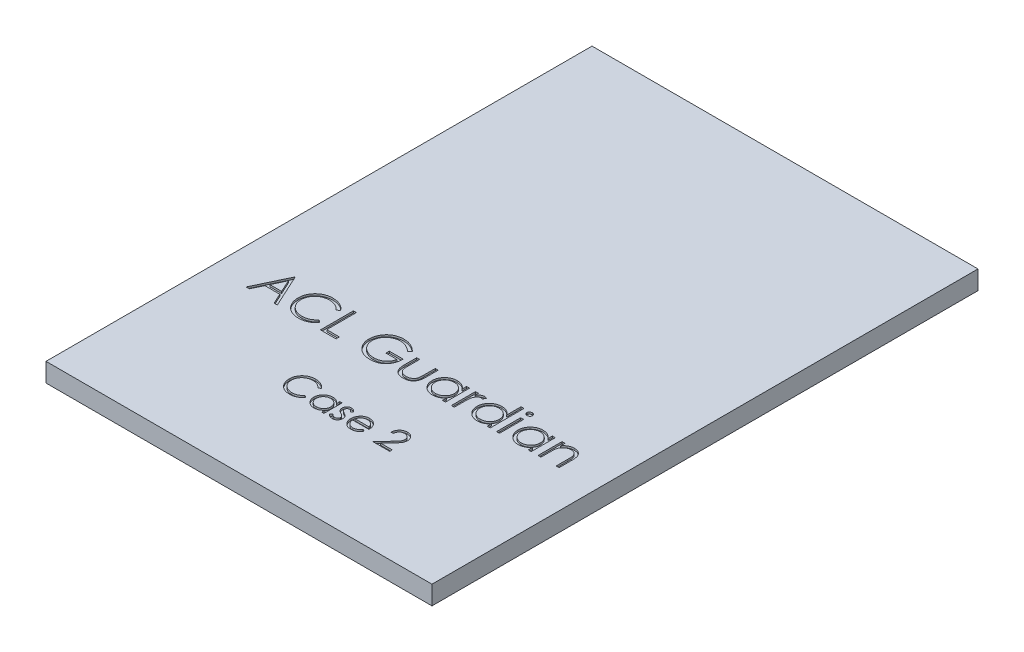
from build123d import *

# Parameters (mm, degrees)
SKETCH1_W           = 41
SKETCH1_H           = 2
BOSS_EXTRUDE1_DEPTH = 58
SKETCH2_W           = 0.314102564
SKETCH2_H           = 2.557692308
CUT_EXTRUDE1_DEPTH  = 0.2


with BuildPart() as part:
    # Sketch1 → Boss-Extrude1 (new body)
    with BuildSketch(Plane.XY):
        with Locations((20.5, -1)):
            Rectangle(SKETCH1_W, SKETCH1_H)
    extrude(amount=BOSS_EXTRUDE1_DEPTH)

    # Sketch2 → Cut-Extrude1 (cut)
    # profile 1 of 17: a face of its own
    with BuildSketch(Plane(origin=(0, 0, 0), x_dir=(1, 0, 0), z_dir=(0, 1, 0))):
        Polygon((5.490384615, -37.03327226), (7.105769231, -40.53327226), (6.764322917, -40.53327226), (6.246895032, -39.411477388), (4.66025641, -39.411477388), (4.12880609, -40.53327226), (3.78525641, -40.53327226), (5.445512821, -37.03327226), align=None)
        Polygon((5.464443109, -37.716164888), (4.831330128, -39.052503029), (6.081430288, -39.052503029), align=None, mode=Mode.SUBTRACT)
    # profile 2 of 17: a face of its own
    with BuildSketch(Plane(origin=(0, 0, 0), x_dir=(1, 0, 0), z_dir=(0, 1, 0))):
        with BuildLine():
            Line((10.96474359, -37.675499824), (10.689903846, -37.885836362))
            add(Edge.make_bspline(
                [(10.689903846, -37.885836362), (10.670297958, -37.862470393), (10.631350511, -37.816053477), (10.568691308, -37.750873932), (10.503389666, -37.689808671), (10.435470544, -37.632566791), (10.363711425, -37.581150026), (10.289850626, -37.532878923), (10.212652581, -37.489611185), (10.105900846, -37.437148199), (9.966252998, -37.382402044), (9.790458159, -37.336498812), (9.60694706, -37.307277637), (9.481749461, -37.304112795), (9.41806891, -37.302503029)],
                knots=[0, 0, 0, 0, 0.757959112, 1.505699292, 2.245454638, 2.979532153, 3.711538275, 4.438200793, 5.171680507, 5.909471876, 7.393775596, 8.890124382, 10.418191784, 12, 12, 12, 12], degree=3))
            add(Edge.make_bspline(
                [(9.41806891, -37.302503029), (9.382985611, -37.302906992), (9.313144618, -37.303711167), (9.209496145, -37.314320293), (9.107783094, -37.329231503), (9.008071627, -37.351356826), (8.910488669, -37.379329445), (8.814396267, -37.412754859), (8.721185667, -37.454109699), (8.629567429, -37.499817959), (8.541788218, -37.551445403), (8.45873317, -37.607758755), (8.380705202, -37.668127852), (8.30764259, -37.732778958), (8.239470642, -37.801420919), (8.176683331, -37.87478526), (8.119497921, -37.952637434), (8.066780896, -38.033950841), (8.019568162, -38.118488633), (7.980038283, -38.206563703), (7.945033161, -38.296667806), (7.917333918, -38.389818967), (7.895409401, -38.485361733), (7.880281738, -38.583552521), (7.869793267, -38.684186201), (7.86899309, -38.752395513), (7.868589744, -38.786777869)],
                knots=[0, 0, 0, 0, 1.054917814, 2.100044995, 3.131103042, 4.146048494, 5.169673617, 6.183595914, 7.203665975, 8.234915748, 9.262203917, 10.264457458, 11.251630812, 12.227803204, 13.197192746, 14.159520551, 15.12972552, 16.100847026, 17.073214652, 18.039054194, 19.002613845, 19.979014051, 20.95965708, 21.949030935, 22.966165397, 24, 24, 24, 24], degree=3))
            add(Edge.make_bspline(
                [(7.868589744, -38.786777869), (7.869851563, -38.838509189), (7.872328977, -38.940076774), (7.894377311, -39.088847384), (7.927882402, -39.231368058), (7.978097979, -39.3667479), (8.04001703, -39.496656258), (8.118257641, -39.618895112), (8.208874179, -39.735311676), (8.313148598, -39.843154624), (8.427554414, -39.941668349), (8.550302326, -40.028418931), (8.681086613, -40.100733813), (8.818463244, -40.16090976), (8.963489358, -40.207166487), (9.11590416, -40.239730611), (9.275376155, -40.260972791), (9.384345555, -40.263006479), (9.439803686, -40.264041491)],
                knots=[0, 0, 0, 0, 1.029171465, 2.020641659, 2.987623507, 3.938342917, 4.889210282, 5.84687017, 6.821220943, 7.821438502, 8.827599549, 9.822697543, 10.807740252, 11.797342354, 12.80366471, 13.83203677, 14.896651826, 16, 16, 16, 16], degree=3))
            add(Edge.make_bspline(
                [(9.439803686, -40.264041491), (9.500906375, -40.262352711), (9.621171084, -40.259028788), (9.79753911, -40.230869539), (9.966374876, -40.185211621), (10.127687462, -40.121313699), (10.281022109, -40.038248411), (10.426618769, -39.937550534), (10.564600339, -39.818262201), (10.647571622, -39.727179073), (10.689903846, -39.680708157)],
                knots=[0, 0, 0, 0, 1.028121516, 2.023589091, 2.998037872, 3.967518031, 4.937445131, 5.927275754, 6.942489185, 8, 8, 8, 8], degree=3))
            Line((10.689903846, -39.680708157), (10.96474359, -39.88894133))
            add(Edge.make_bspline(
                [(10.96474359, -39.88894133), (10.94262548, -39.917479782), (10.898495205, -39.974419988), (10.827037188, -40.054691698), (10.75175989, -40.130195734), (10.67210418, -40.200323355), (10.588986389, -40.266477821), (10.500914076, -40.326779652), (10.409045044, -40.382070536), (10.313690565, -40.432697461), (10.214951952, -40.477614708), (10.112947517, -40.516068475), (10.008116942, -40.549193365), (9.900455433, -40.576445302), (9.789739676, -40.597716386), (9.676369202, -40.61193606), (9.560099327, -40.621677975), (9.481657906, -40.622565891), (9.441907051, -40.62301585)],
                knots=[0, 0, 0, 0, 0.986787822, 1.968848986, 2.935600012, 3.899624008, 4.868462664, 5.837806735, 6.815139263, 7.798259679, 8.787526145, 9.778297419, 10.776456485, 11.791383307, 12.812564526, 13.85620153, 14.913611965, 16, 16, 16, 16], degree=3))
            add(Edge.make_bspline(
                [(9.441907051, -40.62301585), (9.404263384, -40.622753857), (9.329827694, -40.622235799), (9.219928943, -40.613843632), (9.112939362, -40.602393895), (9.009164736, -40.585153764), (8.908038761, -40.564809424), (8.810478176, -40.537538167), (8.715522966, -40.506989), (8.623554625, -40.471084014), (8.534494925, -40.430567831), (8.448631114, -40.384776272), (8.366002682, -40.334094408), (8.285797261, -40.279639397), (8.209199677, -40.219662095), (8.135546152, -40.154995461), (8.064423676, -40.08585745), (8.020420991, -40.036002597), (7.998297276, -40.010936523)],
                knots=[0, 0, 0, 0, 1.114604814, 2.203992996, 3.262667896, 4.300477797, 5.318619304, 6.316056647, 7.298880507, 8.271930387, 9.238335007, 10.195173496, 11.151986948, 12.108099108, 13.064862484, 14.031167946, 15.010108607, 16, 16, 16, 16], degree=3))
            add(Edge.make_bspline(
                [(7.998297276, -40.010936523), (7.962861632, -39.967395334), (7.892418155, -39.880838623), (7.802292472, -39.740552642), (7.725144917, -39.594084433), (7.662768996, -39.440664504), (7.614006263, -39.280637117), (7.580225068, -39.113921603), (7.558273463, -38.940673661), (7.555763174, -38.822836872), (7.554487179, -38.762939728)],
                knots=[0, 0, 0, 0, 0.994628077, 1.977248131, 2.950237994, 3.925870899, 4.908910175, 5.911660606, 6.938484602, 8, 8, 8, 8], degree=3))
            add(Edge.make_bspline(
                [(7.554487179, -38.762939728), (7.556042373, -38.699984274), (7.559102119, -38.57612335), (7.585097915, -38.394349396), (7.626916711, -38.220197997), (7.6863136, -38.053994253), (7.761618951, -37.894863973), (7.854645565, -37.744022768), (7.964312707, -37.600505968), (8.089760275, -37.466491217), (8.22732761, -37.343951864), (8.374646424, -37.23614566), (8.531428371, -37.146428144), (8.695946222, -37.071431982), (8.869431904, -37.013787519), (9.051515273, -36.973434332), (9.241854188, -36.948317216), (9.371716614, -36.945142008), (9.437700321, -36.94352867)],
                knots=[0, 0, 0, 0, 1.032925535, 2.032216505, 3.007276963, 3.968222605, 4.92396291, 5.891752235, 6.871517503, 7.883894988, 8.900124299, 9.891468569, 10.874487609, 11.85992873, 12.854644235, 13.869047385, 14.917252991, 16, 16, 16, 16], degree=3))
            add(Edge.make_bspline(
                [(9.437700321, -36.94352867), (9.477914792, -36.944010808), (9.55751529, -36.944965152), (9.675267942, -36.954271294), (9.789910269, -36.969784901), (9.901521251, -36.99090097), (10.010643867, -37.017108292), (10.116444108, -37.05124859), (10.219542795, -37.090285121), (10.319289703, -37.135243587), (10.415206253, -37.185710329), (10.507262572, -37.241125952), (10.594727431, -37.301421758), (10.678216279, -37.366084933), (10.75633249, -37.436483493), (10.831293969, -37.510681089), (10.900555047, -37.590814913), (10.943308242, -37.647219847), (10.96474359, -37.675499824)],
                knots=[0, 0, 0, 0, 1.096760587, 2.17092713, 3.219439832, 4.250915756, 5.268269357, 6.278326846, 7.281116186, 8.274029601, 9.260640565, 10.235837813, 11.203064059, 12.156899882, 13.114053108, 14.069676657, 15.032185724, 16, 16, 16, 16], degree=3))
        make_face()
    # profile 3 of 17: a face of its own
    with BuildSketch(Plane(origin=(0, 0, 0), x_dir=(1, 0, 0), z_dir=(0, 1, 0))):
        Polygon((11.682692308, -37.03327226), (11.996794872, -37.03327226), (11.996794872, -40.174297901), (13.342948718, -40.174297901), (13.342948718, -40.53327226), (11.682692308, -40.53327226), align=None)
    # profile 4 of 17: a face of its own
    with BuildSketch(Plane(origin=(0, 0, 0), x_dir=(1, 0, 0), z_dir=(0, 1, 0))):
        with BuildLine():
            Line((18.548076923, -37.630628029), (18.278846154, -37.885836362))
            add(Edge.make_bspline(
                [(18.278846154, -37.885836362), (18.230127266, -37.840005499), (18.133851219, -37.749436636), (17.976890977, -37.631925641), (17.813127343, -37.531259541), (17.643414846, -37.449353305), (17.471956292, -37.384000544), (17.301027516, -37.337472404), (17.132381814, -37.307799866), (17.020214596, -37.304251497), (16.96494391, -37.302503029)],
                knots=[0, 0, 0, 0, 1.08915593, 2.152340314, 3.188132944, 4.216796309, 5.218260357, 6.173443236, 7.099959455, 8, 8, 8, 8], degree=3))
            add(Edge.make_bspline(
                [(16.96494391, -37.302503029), (16.93102921, -37.302916635), (16.86328777, -37.303742774), (16.762665826, -37.314286989), (16.663099189, -37.329451853), (16.564775814, -37.351393731), (16.467504528, -37.37920279), (16.371623635, -37.413988254), (16.276954281, -37.454543498), (16.1843882, -37.501405972), (16.094647696, -37.552885818), (16.00989086, -37.609934359), (15.929577461, -37.670723149), (15.855217036, -37.736774128), (15.786381849, -37.807488993), (15.721433478, -37.8815523), (15.662656182, -37.960987518), (15.609565017, -38.044333144), (15.562203398, -38.130125333), (15.520394745, -38.217538323), (15.485297657, -38.306282177), (15.457528201, -38.396468255), (15.434617547, -38.487398845), (15.41849994, -38.579703566), (15.409413218, -38.673481251), (15.407841438, -38.736278509), (15.407051282, -38.76784758)],
                knots=[0, 0, 0, 0, 1.02818874, 2.053710826, 3.065248034, 4.081641283, 5.106893873, 6.131558223, 7.173050175, 8.228653731, 9.27666206, 10.308777013, 11.325269123, 12.329503258, 13.32196095, 14.316845687, 15.314881793, 16.315733098, 17.311955233, 18.285320748, 19.252783886, 20.203351036, 21.145449891, 22.095197417, 23.042428769, 24, 24, 24, 24], degree=3))
            add(Edge.make_bspline(
                [(15.407051282, -38.76784758), (15.407807, -38.800118398), (15.409316373, -38.864571911), (15.418976693, -38.960765984), (15.436904933, -39.055531386), (15.460872642, -39.149179519), (15.490853458, -39.241870767), (15.528226124, -39.333203277), (15.572491724, -39.423173668), (15.623728276, -39.510971285), (15.67991448, -39.596494308), (15.742857561, -39.67705383), (15.809718144, -39.753722607), (15.882932044, -39.824798371), (15.960151586, -39.892182268), (16.043683862, -39.954017789), (16.131886323, -40.011496013), (16.224893535, -40.063892532), (16.321696317, -40.110701068), (16.42095307, -40.152324964), (16.522980886, -40.186604301), (16.627243576, -40.214542405), (16.733616847, -40.237442702), (16.84264065, -40.252175183), (16.953513358, -40.262866014), (17.02825199, -40.263647684), (17.065905449, -40.264041491)],
                knots=[0, 0, 0, 0, 0.93586088, 1.869166235, 2.799637598, 3.729985548, 4.670839027, 5.622275134, 6.589130586, 7.576015415, 8.568469353, 9.55398029, 10.53834874, 11.515998671, 12.510579167, 13.508179873, 14.527009472, 15.561807829, 16.601455013, 17.643573243, 18.680854198, 19.719860599, 20.772568776, 21.833555941, 22.908541556, 24, 24, 24, 24], degree=3))
            add(Edge.make_bspline(
                [(17.065905449, -40.264041491), (17.111283796, -40.263092914), (17.200391553, -40.261230231), (17.331377996, -40.246729941), (17.457181067, -40.224083147), (17.57744727, -40.190917251), (17.692316291, -40.148613576), (17.802209232, -40.097618189), (17.906260891, -40.03597513), (18.004784064, -39.966401263), (18.09554125, -39.888886431), (18.177395374, -39.805241976), (18.249040863, -39.715873909), (18.311545562, -39.621308594), (18.363254217, -39.520763289), (18.405697012, -39.414730726), (18.438230303, -39.303163214), (18.451585278, -39.226071582), (18.458333333, -39.187118414)],
                knots=[0, 0, 0, 0, 1.13008108, 2.219097802, 3.278683437, 4.311054135, 5.322181354, 6.324827112, 7.324222904, 8.330512327, 9.32562643, 10.293043162, 11.24128371, 12.174520618, 13.111833804, 14.052305215, 15.015860969, 16, 16, 16, 16], degree=3))
            Line((18.458333333, -39.187118414), (17.291666667, -39.187118414))
            Line((17.291666667, -39.187118414), (17.291666667, -38.828144055))
            Line((17.291666667, -38.828144055), (18.772435897, -38.828144055))
            add(Edge.make_bspline(
                [(18.772435897, -38.828144055), (18.770730049, -38.895051543), (18.767391396, -39.026001585), (18.74397248, -39.216971856), (18.706155968, -39.397343549), (18.654495656, -39.567306621), (18.587620376, -39.726620214), (18.506247847, -39.87544608), (18.409075726, -40.012822761), (18.299565285, -40.139871764), (18.176665327, -40.253200977), (18.043696707, -40.352806915), (17.900439738, -40.43670953), (17.747029931, -40.504970192), (17.583969497, -40.558244187), (17.410881118, -40.596015764), (17.227999517, -40.618645727), (17.10266284, -40.621537107), (17.038561699, -40.62301585)],
                knots=[0, 0, 0, 0, 1.140356446, 2.231883559, 3.274166699, 4.278491846, 5.25512956, 6.21435461, 7.1637429, 8.11826594, 9.068280886, 10.0076534, 10.945064095, 11.891975133, 12.864533718, 13.863980011, 14.907571808, 16, 16, 16, 16], degree=3))
            add(Edge.make_bspline(
                [(17.038561699, -40.62301585), (16.999051563, -40.622446728), (16.921124843, -40.621324238), (16.806033914, -40.61334689), (16.694116294, -40.601066314), (16.585388285, -40.582521191), (16.479449943, -40.559806536), (16.376830358, -40.530719818), (16.277138616, -40.497051118), (16.18022063, -40.458755445), (16.086956083, -40.414383788), (15.996929566, -40.365074149), (15.909643441, -40.311080788), (15.825692276, -40.251469942), (15.744638654, -40.186687482), (15.667005211, -40.116603563), (15.592357333, -40.041432443), (15.545596869, -39.988053434), (15.522035256, -39.961156875)],
                knots=[0, 0, 0, 0, 1.107784379, 2.184907829, 3.233506516, 4.263428166, 5.276301166, 6.270063455, 7.25232949, 8.225834625, 9.190232166, 10.146266622, 11.1027726, 12.066435141, 13.031522626, 14.010570082, 14.99756817, 16, 16, 16, 16], degree=3))
            add(Edge.make_bspline(
                [(15.522035256, -39.961156875), (15.487849324, -39.918486222), (15.420044912, -39.833853205), (15.332766755, -39.698253261), (15.258365352, -39.5578514), (15.19799753, -39.412256772), (15.150859444, -39.261605559), (15.117053191, -39.106090268), (15.097245902, -38.945510637), (15.094392365, -38.836845373), (15.092948718, -38.781870016)],
                knots=[0, 0, 0, 0, 1.023165419, 2.029347347, 3.013907458, 3.994755782, 4.975994455, 5.96558838, 6.970761222, 8, 8, 8, 8], degree=3))
            add(Edge.make_bspline(
                [(15.092948718, -38.781870016), (15.093480956, -38.740703763), (15.094538668, -38.658894456), (15.107364184, -38.537437149), (15.125765602, -38.418136456), (15.152812657, -38.3010899), (15.186908921, -38.186219308), (15.229462407, -38.073471345), (15.279007303, -37.962779473), (15.3365928, -37.854905605), (15.400677259, -37.751281192), (15.470227479, -37.652323389), (15.54623108, -37.559834324), (15.627446879, -37.472642676), (15.714843869, -37.391843829), (15.807603293, -37.316689718), (15.905796636, -37.247079532), (16.009732816, -37.184109697), (16.1178605, -37.127546077), (16.229920502, -37.077956865), (16.345878613, -37.03697355), (16.46486609, -37.00219977), (16.587783591, -36.976484629), (16.713739128, -36.957835884), (16.84338924, -36.945075284), (16.931025269, -36.944049029), (16.975460737, -36.94352867)],
                knots=[0, 0, 0, 0, 1.008945113, 2.00506715, 2.99143336, 3.967273523, 4.948097931, 5.927297278, 6.919902385, 7.919676788, 8.923139349, 9.905703106, 10.883022732, 11.856032218, 12.825136022, 13.798837087, 14.781400844, 15.773989409, 16.776158564, 17.77167057, 18.775803737, 19.789618931, 20.80898985, 21.851988756, 22.910860228, 24, 24, 24, 24], degree=3))
            add(Edge.make_bspline(
                [(16.975460737, -36.94352867), (17.011698981, -36.944108162), (17.08355516, -36.945257226), (17.190480892, -36.953221874), (17.295753907, -36.965845755), (17.399530296, -36.983072542), (17.501456663, -37.006536232), (17.601823368, -37.034614517), (17.700775904, -37.067306339), (17.798004153, -37.106295186), (17.89416187, -37.150548811), (17.98978371, -37.200362233), (18.084542956, -37.256587238), (18.178603937, -37.319390773), (18.272559795, -37.387694191), (18.364924438, -37.463451015), (18.457927382, -37.54367377), (18.517729196, -37.601355954), (18.548076923, -37.630628029)],
                knots=[0, 0, 0, 0, 0.985871117, 1.954866573, 2.915460327, 3.869826059, 4.81536089, 5.759505086, 6.70452669, 7.649098992, 8.607881297, 9.583363685, 10.581137262, 11.603961102, 12.659522466, 13.73993555, 14.853081303, 16, 16, 16, 16], degree=3))
        make_face()
    # profile 5 of 17: a face of its own
    with BuildSketch(Plane(origin=(0, 0, 0), x_dir=(1, 0, 0), z_dir=(0, 1, 0))):
        with BuildLine():
            Line((19.355769231, -37.975579952), (19.669871795, -37.975579952))
            Line((19.669871795, -37.975579952), (19.669871795, -39.161878029))
            add(Edge.make_bspline(
                [(19.669871795, -39.161878029), (19.6700137, -39.196700778), (19.670285157, -39.263315066), (19.672126098, -39.359170253), (19.676456192, -39.446586966), (19.681870016, -39.525615702), (19.688832152, -39.596243094), (19.697115513, -39.658222451), (19.706373935, -39.712256635), (19.715436648, -39.744799991), (19.719651442, -39.75993492)],
                knots=[0, 0, 0, 0, 1.388932606, 2.656963016, 3.823490214, 4.879454478, 5.816252168, 6.653371382, 7.373723809, 8, 8, 8, 8], degree=3))
            add(Edge.make_bspline(
                [(19.719651442, -39.75993492), (19.726412897, -39.778957791), (19.739795238, -39.816608052), (19.764068722, -39.870997057), (19.794097059, -39.92137234), (19.826956887, -39.969676412), (19.864856294, -40.014478399), (19.907315765, -40.055702643), (19.952914002, -40.094906734), (20.020669026, -40.141291526), (20.113328292, -40.191006856), (20.234981047, -40.233902675), (20.366885273, -40.259538495), (20.458049992, -40.26251275), (20.504907853, -40.264041491)],
                knots=[0, 0, 0, 0, 0.725840625, 1.436591201, 2.137033971, 2.831655856, 3.53531722, 4.242432219, 4.957935707, 5.694543706, 7.190802206, 8.724350549, 10.316345118, 12, 12, 12, 12], degree=3))
            add(Edge.make_bspline(
                [(20.504907853, -40.264041491), (20.55176136, -40.262480242), (20.642414229, -40.259459515), (20.772869198, -40.234675976), (20.892120612, -40.193270287), (20.998971564, -40.135462875), (21.092937404, -40.064720813), (21.171241823, -39.981712004), (21.235849077, -39.889062617), (21.264058498, -39.819938338), (21.278245192, -39.785175305)],
                knots=[0, 0, 0, 0, 1.157059328, 2.238695713, 3.266970494, 4.264342957, 5.228770407, 6.160125903, 7.074715775, 8, 8, 8, 8], degree=3))
            add(Edge.make_bspline(
                [(21.278245192, -39.785175305), (21.282439422, -39.771209006), (21.291711841, -39.740332931), (21.301674192, -39.687953182), (21.310648654, -39.625488578), (21.31831183, -39.552530369), (21.323776993, -39.469269217), (21.326723019, -39.37573114), (21.330051294, -39.27220978), (21.330101811, -39.199742021), (21.330128205, -39.161878029)],
                knots=[0, 0, 0, 0, 0.557542046, 1.232589297, 2.036731608, 2.971723315, 4.038036528, 5.22795436, 6.551621927, 8, 8, 8, 8], degree=3))
            Line((21.330128205, -39.161878029), (21.330128205, -37.975579952))
            Line((21.330128205, -37.975579952), (21.644230769, -37.975579952))
            Line((21.644230769, -37.975579952), (21.644230769, -39.22077226))
            add(Edge.make_bspline(
                [(21.644230769, -39.22077226), (21.643789074, -39.263079431), (21.642932126, -39.345161131), (21.637424783, -39.464445243), (21.62797517, -39.575607487), (21.613632485, -39.678706707), (21.59676681, -39.773664189), (21.575010537, -39.860601635), (21.5490323, -39.939251189), (21.519726785, -40.010992966), (21.485104917, -40.07603986), (21.448277897, -40.137775677), (21.405753125, -40.194668612), (21.36098289, -40.249550749), (21.311181235, -40.299692276), (21.257281376, -40.346243752), (21.200041956, -40.389916784), (21.138192758, -40.429008064), (21.072636695, -40.464224709), (21.003292838, -40.495440787), (20.92931184, -40.520143364), (20.851648203, -40.54145403), (20.769921423, -40.558168499), (20.68421029, -40.569955066), (20.594543674, -40.577180397), (20.533434214, -40.577817441), (20.502103365, -40.578144055)],
                knots=[0, 0, 0, 0, 1.493040784, 2.896703357, 4.213163133, 5.428574705, 6.569057535, 7.615249723, 8.588095153, 9.490268104, 10.346124644, 11.18633936, 12.024365274, 12.850166724, 13.684164916, 14.514361689, 15.362232829, 16.222528818, 17.093394965, 17.986930858, 18.902426812, 19.842810585, 20.827885679, 21.843828298, 22.894529745, 24, 24, 24, 24], degree=3))
            add(Edge.make_bspline(
                [(20.502103365, -40.578144055), (20.471006851, -40.577804347), (20.409899306, -40.577136791), (20.320228062, -40.569994984), (20.234279456, -40.558186813), (20.152359057, -40.541331596), (20.07438466, -40.520292526), (20.00004042, -40.49528899), (19.930196857, -40.464208508), (19.864014853, -40.429230951), (19.802012465, -40.389665676), (19.743903887, -40.346297636), (19.689767034, -40.299191573), (19.639589966, -40.248544216), (19.59407699, -40.193727279), (19.552660948, -40.135181719), (19.514704243, -40.07348763), (19.480351452, -40.007424468), (19.450839697, -39.934852458), (19.424784451, -39.854555361), (19.403473812, -39.765652844), (19.386131344, -39.668220916), (19.372179904, -39.562725874), (19.362493761, -39.448557459), (19.357077931, -39.325993767), (19.356214869, -39.241343877), (19.355769231, -39.197635241)],
                knots=[0, 0, 0, 0, 1.083640291, 2.129454052, 3.13281866, 4.105697902, 5.042300162, 5.946461698, 6.836384745, 7.703652036, 8.553297018, 9.397182691, 10.228592656, 11.052265423, 11.879314572, 12.708807002, 13.549817954, 14.402308542, 15.300838682, 16.27712199, 17.341985831, 18.484375296, 19.725102775, 21.0496083, 22.476576903, 24, 24, 24, 24], degree=3))
            Line((19.355769231, -39.197635241), (19.355769231, -37.975579952))
        make_face()
    # profile 6 of 17: a face of its own
    with BuildSketch(Plane(origin=(0, 0, 0), x_dir=(1, 0, 0), z_dir=(0, 1, 0))):
        with BuildLine():
            Line((24.96474359, -37.975579952), (24.96474359, -40.53327226))
            Line((24.96474359, -40.53327226), (24.650641026, -40.53327226))
            Line((24.650641026, -40.53327226), (24.650641026, -40.090864407))
            add(Edge.make_bspline(
                [(24.650641026, -40.090864407), (24.615222235, -40.130904001), (24.54610202, -40.209041772), (24.430660902, -40.311123945), (24.308292724, -40.395502266), (24.179591403, -40.463652182), (24.044673159, -40.514844238), (23.903837072, -40.551230397), (23.757025691, -40.574624233), (23.656773336, -40.576960254), (23.605969551, -40.578144055)],
                knots=[0, 0, 0, 0, 1.074387032, 2.096679803, 3.090159297, 4.057316773, 5.018401886, 5.985159533, 6.978961417, 8, 8, 8, 8], degree=3))
            add(Edge.make_bspline(
                [(23.605969551, -40.578144055), (23.560801597, -40.576917682), (23.471728393, -40.574499222), (23.340699315, -40.555736918), (23.214607066, -40.525606297), (23.093332493, -40.483705407), (22.977660348, -40.428124586), (22.866600251, -40.361583338), (22.760727559, -40.282342507), (22.66165602, -40.191754479), (22.57042402, -40.093359492), (22.490362747, -39.988413945), (22.423609667, -39.877371641), (22.367789587, -39.761638487), (22.324793242, -39.640323568), (22.294819608, -39.5138464), (22.276079161, -39.382356526), (22.273661701, -39.292817003), (22.272435897, -39.247414888)],
                knots=[0, 0, 0, 0, 1.033919861, 2.038935746, 3.024066025, 3.998881131, 4.97069526, 5.957263378, 6.95902576, 7.993208707, 9.027059324, 10.027763471, 11.009749337, 11.988697705, 12.965288445, 13.950418724, 14.960734635, 16, 16, 16, 16], degree=3))
            add(Edge.make_bspline(
                [(22.272435897, -39.247414888), (22.273688869, -39.202951184), (22.276165926, -39.115048841), (22.294619145, -38.985770143), (22.325650154, -38.861251882), (22.369198002, -38.741894939), (22.425039957, -38.627554889), (22.492968044, -38.518150864), (22.572987169, -38.413381467), (22.665239576, -38.31571024), (22.765174346, -38.225489625), (22.872083077, -38.14708058), (22.983306358, -38.079363731), (23.100569368, -38.025710255), (23.222136473, -37.98230115), (23.349089919, -37.952268182), (23.480901498, -37.934570861), (23.57039199, -37.932008097), (23.615785256, -37.930708157)],
                knots=[0, 0, 0, 0, 1.020392517, 2.01726096, 2.990465484, 3.961182959, 4.928053699, 5.906110375, 6.912531644, 7.948652711, 8.985773172, 9.998621852, 10.987621588, 11.969261332, 12.953316658, 13.946091881, 14.958173133, 16, 16, 16, 16], degree=3))
            add(Edge.make_bspline(
                [(23.615785256, -37.930708157), (23.667985115, -37.932145909), (23.770346575, -37.934965272), (23.920074585, -37.958427999), (24.061719063, -37.998066466), (24.196373415, -38.051983964), (24.323554101, -38.123632693), (24.442057085, -38.214012654), (24.553122568, -38.322553841), (24.61750286, -38.405924286), (24.650641026, -38.448837164)],
                knots=[0, 0, 0, 0, 1.038897134, 2.037228247, 3.008116434, 3.962042015, 4.918381754, 5.904844433, 6.921570401, 8, 8, 8, 8], degree=3))
            Line((24.650641026, -38.448837164), (24.650641026, -37.975579952))
            Line((24.650641026, -37.975579952), (24.96474359, -37.975579952))
        make_face()
        with BuildLine():
            add(Edge.make_bspline(
                [(23.619991987, -38.244810721), (23.574077649, -38.246444359), (23.483450049, -38.2496689), (23.350406047, -38.274842395), (23.223092633, -38.31672699), (23.102146559, -38.374008891), (22.989478342, -38.446037627), (22.888784671, -38.533159011), (22.79924197, -38.632996025), (22.723933706, -38.745098135), (22.662543209, -38.865276226), (22.619376177, -38.990900664), (22.59090693, -39.119705642), (22.587998409, -39.207068328), (22.586538462, -39.250920497)],
                knots=[0, 0, 0, 0, 1.031046209, 2.035121221, 3.029706178, 4.034933723, 5.034054252, 6.02443088, 7.017295772, 8.038157696, 9.050218397, 10.03989886, 11.016116709, 12, 12, 12, 12], degree=3))
            add(Edge.make_bspline(
                [(22.586538462, -39.250920497), (22.588403355, -39.294510604), (22.592125832, -39.38151996), (22.618876526, -39.510500537), (22.6637564, -39.636154579), (22.724998462, -39.757415572), (22.801685087, -39.869999673), (22.89057374, -39.971739795), (22.992524021, -40.059229384), (23.105451528, -40.132466957), (23.226059498, -40.191629478), (23.35289343, -40.232795118), (23.483569068, -40.259372898), (23.572421402, -40.262477375), (23.6171875, -40.264041491)],
                knots=[0, 0, 0, 0, 0.979072187, 1.954306742, 2.945804271, 3.96968567, 4.997920485, 5.998718438, 6.996577872, 8.005894225, 9.015743152, 10.005417472, 10.995077863, 12, 12, 12, 12], degree=3))
            add(Edge.make_bspline(
                [(23.6171875, -40.264041491), (23.662634003, -40.262381527), (23.753022589, -40.259080023), (23.886461297, -40.233798758), (24.01595626, -40.192029959), (24.139743488, -40.134130833), (24.255059619, -40.062373477), (24.358557497, -39.978366386), (24.446073465, -39.880663202), (24.520266075, -39.773286749), (24.578441492, -39.655574752), (24.620817551, -39.530240561), (24.645871457, -39.397279813), (24.649029186, -39.306415886), (24.650641026, -39.26003508)],
                knots=[0, 0, 0, 0, 1.01762866, 2.023962475, 3.030623092, 4.058876274, 5.077231937, 6.066672613, 7.034107872, 8.005628644, 8.981990164, 9.965428785, 10.961468474, 12, 12, 12, 12], degree=3))
            add(Edge.make_bspline(
                [(24.650641026, -39.26003508), (24.649681369, -39.22469725), (24.647792462, -39.155141216), (24.633361892, -39.053013699), (24.610406966, -38.955279973), (24.578060796, -38.861837284), (24.535569511, -38.773202268), (24.484321746, -38.688738508), (24.423416296, -38.608885297), (24.3538336, -38.534742226), (24.277668397, -38.467115764), (24.197073857, -38.406751523), (24.11109511, -38.35716275), (24.021178073, -38.316121479), (23.927166738, -38.283462329), (23.828296118, -38.261674635), (23.725617131, -38.246714314), (23.655571076, -38.245451933), (23.619991987, -38.244810721)],
                knots=[0, 0, 0, 0, 1.050140795, 2.067009409, 3.05949893, 4.030605086, 5.00011959, 5.97591094, 6.962425594, 7.979863591, 8.993523472, 9.986985069, 10.967611495, 11.937549037, 12.921786183, 13.919465291, 14.943216303, 16, 16, 16, 16], degree=3))
        make_face(mode=Mode.SUBTRACT)
    # profile 7 of 17: a face of its own
    with BuildSketch(Plane(origin=(0, 0, 0), x_dir=(1, 0, 0), z_dir=(0, 1, 0))):
        with BuildLine():
            Line((25.592948718, -37.975579952), (25.907051282, -37.975579952))
            Line((25.907051282, -37.975579952), (25.907051282, -38.352082356))
            add(Edge.make_bspline(
                [(25.907051282, -38.352082356), (25.930240041, -38.317026528), (25.974588362, -38.249982528), (26.048301291, -38.161313227), (26.123804622, -38.087898181), (26.20145981, -38.029394662), (26.28183791, -37.985581543), (26.363174861, -37.953488508), (26.446750331, -37.934511193), (26.502912255, -37.931977534), (26.531049679, -37.930708157)],
                knots=[0, 0, 0, 0, 1.2804753, 2.448899062, 3.506932113, 4.484331642, 5.4025378, 6.288909075, 7.142734305, 8, 8, 8, 8], degree=3))
            add(Edge.make_bspline(
                [(26.531049679, -37.930708157), (26.552876006, -37.931898684), (26.597785091, -37.93434827), (26.665767681, -37.951559094), (26.735811133, -37.979037117), (26.78095352, -38.00487734), (26.804487179, -38.018348382)],
                knots=[0, 0, 0, 0, 0.901110191, 1.854092781, 2.881294221, 4, 4, 4, 4], degree=3))
            Line((26.804487179, -38.018348382), (26.632011218, -38.290383638))
            add(Edge.make_bspline(
                [(26.632011218, -38.290383638), (26.616902197, -38.283643372), (26.588222382, -38.270849056), (26.546267816, -38.255707046), (26.507586479, -38.24679113), (26.482942921, -38.245440413), (26.471454327, -38.244810721)],
                knots=[0, 0, 0, 0, 1.180555205, 2.24091978, 3.179933427, 4, 4, 4, 4], degree=3))
            add(Edge.make_bspline(
                [(26.471454327, -38.244810721), (26.446248593, -38.246490759), (26.394836203, -38.249917548), (26.319351704, -38.276856356), (26.246104499, -38.320381596), (26.187932836, -38.368652708), (26.142890583, -38.415200505), (26.110750358, -38.455848908), (26.081267611, -38.501427539), (26.05309739, -38.551157223), (26.027431096, -38.605887069), (26.003476427, -38.665070282), (25.981817564, -38.728775411), (25.96946732, -38.773157931), (25.963141026, -38.795892452)],
                knots=[0, 0, 0, 0, 1.125678352, 2.296057538, 3.5422874, 4.923748041, 5.663163013, 6.437101912, 7.23742474, 8.08941207, 8.991984279, 9.93940061, 10.944477711, 12, 12, 12, 12], degree=3))
            add(Edge.make_bspline(
                [(25.963141026, -38.795892452), (25.958408632, -38.816169626), (25.947926741, -38.861082024), (25.937735203, -38.936430549), (25.927665685, -39.025454208), (25.920569066, -39.128400801), (25.913991024, -39.245013245), (25.910280942, -39.37546919), (25.907177801, -39.519902541), (25.907094735, -39.620876895), (25.907051282, -39.673696939)],
                knots=[0, 0, 0, 0, 0.566838948, 1.255505196, 2.06880316, 3.007127437, 4.065329342, 5.249902469, 6.561414163, 8, 8, 8, 8], degree=3))
            Line((25.907051282, -39.673696939), (25.907051282, -40.53327226))
            Line((25.907051282, -40.53327226), (25.592948718, -40.53327226))
            Line((25.592948718, -40.53327226), (25.592948718, -37.975579952))
        make_face()
    # profile 8 of 17: a face of its own
    with BuildSketch(Plane(origin=(0, 0, 0), x_dir=(1, 0, 0), z_dir=(0, 1, 0))):
        with BuildLine():
            Line((29.721153846, -36.94352867), (29.721153846, -40.53327226))
            Line((29.721153846, -40.53327226), (29.407051282, -40.53327226))
            Line((29.407051282, -40.53327226), (29.407051282, -40.090864407))
            add(Edge.make_bspline(
                [(29.407051282, -40.090864407), (29.371632491, -40.130904001), (29.302512276, -40.209041772), (29.187071158, -40.311123945), (29.06470298, -40.395502266), (28.936001659, -40.463652182), (28.801083416, -40.514844238), (28.660247329, -40.551230397), (28.513435948, -40.574624233), (28.413183593, -40.576960254), (28.362379808, -40.578144055)],
                knots=[0, 0, 0, 0, 1.074387032, 2.096679803, 3.090159297, 4.057316773, 5.018401886, 5.985159533, 6.978961417, 8, 8, 8, 8], degree=3))
            add(Edge.make_bspline(
                [(28.362379808, -40.578144055), (28.317211854, -40.576917682), (28.228138649, -40.574499222), (28.097109572, -40.555736918), (27.971017322, -40.525606297), (27.84974275, -40.483705407), (27.734070604, -40.428124586), (27.623010508, -40.361583338), (27.517137816, -40.282342507), (27.418066277, -40.191754479), (27.326834276, -40.093359492), (27.246773004, -39.988413945), (27.180019924, -39.877371641), (27.124199843, -39.761638487), (27.081203499, -39.640323568), (27.051229864, -39.5138464), (27.032489418, -39.382356526), (27.030071957, -39.292817003), (27.028846154, -39.247414888)],
                knots=[0, 0, 0, 0, 1.033919861, 2.038935746, 3.024066025, 3.998881131, 4.97069526, 5.957263378, 6.95902576, 7.993208707, 9.027059324, 10.027763471, 11.009749337, 11.988697705, 12.965288445, 13.950418724, 14.960734635, 16, 16, 16, 16], degree=3))
            add(Edge.make_bspline(
                [(27.028846154, -39.247414888), (27.030099125, -39.202951184), (27.032576182, -39.115048841), (27.051029402, -38.985770143), (27.082060411, -38.861251882), (27.125608258, -38.741894939), (27.181450213, -38.627554889), (27.2493783, -38.518150864), (27.329397425, -38.413381467), (27.421649832, -38.31571024), (27.521584602, -38.225489625), (27.628493333, -38.14708058), (27.739716614, -38.079363731), (27.856979625, -38.025710255), (27.97854673, -37.98230115), (28.105500175, -37.952268182), (28.237311754, -37.934570861), (28.326802246, -37.932008097), (28.372195513, -37.930708157)],
                knots=[0, 0, 0, 0, 1.020392517, 2.01726096, 2.990465484, 3.961182959, 4.928053699, 5.906110375, 6.912531644, 7.948652711, 8.985773172, 9.998621852, 10.987621588, 11.969261332, 12.953316658, 13.946091881, 14.958173133, 16, 16, 16, 16], degree=3))
            add(Edge.make_bspline(
                [(28.372195513, -37.930708157), (28.424412321, -37.932275253), (28.526908111, -37.935351289), (28.676806633, -37.961057656), (28.818594243, -38.004220533), (28.953087231, -38.063311815), (29.079483791, -38.140112566), (29.198710432, -38.232864014), (29.308693754, -38.34419116), (29.373765577, -38.427802733), (29.407051282, -38.470571939)],
                knots=[0, 0, 0, 0, 1.031072012, 2.023879775, 2.993683497, 3.952812103, 4.918022106, 5.908088563, 6.929940113, 8, 8, 8, 8], degree=3))
            Line((29.407051282, -38.470571939), (29.407051282, -36.94352867))
            Line((29.407051282, -36.94352867), (29.721153846, -36.94352867))
        make_face()
        with BuildLine():
            add(Edge.make_bspline(
                [(28.376402244, -38.244810721), (28.330487906, -38.246444359), (28.239860306, -38.2496689), (28.106816304, -38.274842395), (27.97950289, -38.31672699), (27.858556815, -38.374008891), (27.745888599, -38.446037627), (27.645194928, -38.533159011), (27.555652227, -38.632996025), (27.480343962, -38.745098135), (27.418953465, -38.865276226), (27.375786433, -38.990900664), (27.347317186, -39.119705642), (27.344408665, -39.207068328), (27.342948718, -39.250920497)],
                knots=[0, 0, 0, 0, 1.031046209, 2.035121221, 3.029706178, 4.034933723, 5.034054252, 6.02443088, 7.017295772, 8.038157696, 9.050218397, 10.03989886, 11.016116709, 12, 12, 12, 12], degree=3))
            add(Edge.make_bspline(
                [(27.342948718, -39.250920497), (27.344813611, -39.294510604), (27.348536088, -39.38151996), (27.375286783, -39.510500537), (27.420166656, -39.636154579), (27.481408719, -39.757415572), (27.558095343, -39.869999673), (27.646983996, -39.971739795), (27.748934277, -40.059229384), (27.861861784, -40.132466957), (27.982469755, -40.191629478), (28.109303686, -40.232795118), (28.239979324, -40.259372898), (28.328831658, -40.262477375), (28.373597756, -40.264041491)],
                knots=[0, 0, 0, 0, 0.979072187, 1.954306742, 2.945804271, 3.96968567, 4.997920485, 5.998718438, 6.996577872, 8.005894225, 9.015743152, 10.005417472, 10.995077863, 12, 12, 12, 12], degree=3))
            add(Edge.make_bspline(
                [(28.373597756, -40.264041491), (28.419044259, -40.262381527), (28.509432846, -40.259080023), (28.642871554, -40.233798758), (28.772366516, -40.192029959), (28.896153745, -40.134130833), (29.011469876, -40.062373477), (29.114967754, -39.978366386), (29.202483722, -39.880663202), (29.276676331, -39.773286749), (29.334851748, -39.655574752), (29.377227807, -39.530240561), (29.402281713, -39.397279813), (29.405439443, -39.306415886), (29.407051282, -39.26003508)],
                knots=[0, 0, 0, 0, 1.01762866, 2.023962475, 3.030623092, 4.058876274, 5.077231937, 6.066672613, 7.034107872, 8.005628644, 8.981990164, 9.965428785, 10.961468474, 12, 12, 12, 12], degree=3))
            add(Edge.make_bspline(
                [(29.407051282, -39.26003508), (29.406091626, -39.22469725), (29.404202718, -39.155141216), (29.389772149, -39.053013699), (29.366817222, -38.955279973), (29.334471052, -38.861837284), (29.291979768, -38.773202268), (29.240732002, -38.688738508), (29.179826552, -38.608885297), (29.110243856, -38.534742226), (29.034078654, -38.467115764), (28.953484113, -38.406751523), (28.867505366, -38.35716275), (28.777588329, -38.316121479), (28.683576995, -38.283462329), (28.584706375, -38.261674635), (28.482027388, -38.246714314), (28.411981332, -38.245451933), (28.376402244, -38.244810721)],
                knots=[0, 0, 0, 0, 1.050140795, 2.067009409, 3.05949893, 4.030605086, 5.00011959, 5.97591094, 6.962425594, 7.979863591, 8.993523472, 9.986985069, 10.967611495, 11.937549037, 12.921786183, 13.919465291, 14.943216303, 16, 16, 16, 16], degree=3))
        make_face(mode=Mode.SUBTRACT)
    # profile 9 of 17: a face of its own
    with BuildSketch(Plane(origin=(0, 0, 0), x_dir=(1, 0, 0), z_dir=(0, 1, 0))):
        with BuildLine():
            add(Edge.make_bspline(
                [(30.549879808, -36.898656875), (30.569371123, -36.899561028), (30.607538863, -36.901331532), (30.662732131, -36.916493009), (30.712989143, -36.942192694), (30.757566876, -36.976672375), (30.795818763, -37.017221818), (30.822599473, -37.064482787), (30.839811869, -37.115541426), (30.841890424, -37.151156515), (30.842948718, -37.169289888)],
                knots=[0, 0, 0, 0, 1.055194115, 2.066272739, 3.074728998, 4.095836921, 5.109056067, 6.073838105, 7.019297344, 8, 8, 8, 8], degree=3))
            add(Edge.make_bspline(
                [(30.842948718, -37.169289888), (30.841866558, -37.186952541), (30.839727256, -37.221869516), (30.822612768, -37.272042988), (30.79559053, -37.318647272), (30.757591404, -37.359117982), (30.712982643, -37.393578602), (30.662733858, -37.419283341), (30.607538409, -37.434443478), (30.56937097, -37.436214167), (30.549879808, -37.437118414)],
                knots=[0, 0, 0, 0, 0.96129708, 1.900370562, 2.859976407, 3.87933698, 4.906634145, 5.921202961, 6.938410037, 8, 8, 8, 8], degree=3))
            add(Edge.make_bspline(
                [(30.549879808, -37.437118414), (30.530611533, -37.436248693), (30.493108352, -37.434555897), (30.43874151, -37.418985879), (30.388913021, -37.393569806), (30.344248348, -37.359343621), (30.307018155, -37.318398723), (30.279919829, -37.27207143), (30.262844868, -37.221862275), (30.260700239, -37.186950109), (30.259615385, -37.169289888)],
                knots=[0, 0, 0, 0, 1.054934014, 2.053291228, 3.073705704, 4.106921865, 5.123545215, 6.088680038, 7.033164197, 8, 8, 8, 8], degree=3))
            add(Edge.make_bspline(
                [(30.259615385, -37.169289888), (30.260676471, -37.151159038), (30.262760512, -37.115548906), (30.279932628, -37.064453873), (30.306792436, -37.017472371), (30.344273, -36.976446872), (30.38890646, -36.942201437), (30.438743205, -36.916790455), (30.493107905, -36.901219116), (30.530611381, -36.899526502), (30.549879808, -36.898656875)],
                knots=[0, 0, 0, 0, 0.98631895, 1.937192651, 2.907499808, 3.917963147, 4.944918757, 5.95915025, 6.951458133, 8, 8, 8, 8], degree=3))
        make_face()
    # profile 10 of 17: a face of its own
    with BuildSketch(Plane(origin=(0, 0, 0), x_dir=(1, 0, 0), z_dir=(0, 1, 0))):
        with Locations((30.551282051, -39.254426106)):
            Rectangle(SKETCH2_W, SKETCH2_H)
    # profile 11 of 17: a face of its own
    with BuildSketch(Plane(origin=(0, 0, 0), x_dir=(1, 0, 0), z_dir=(0, 1, 0))):
        with BuildLine():
            Line((34.073717949, -37.975579952), (34.073717949, -40.53327226))
            Line((34.073717949, -40.53327226), (33.759615385, -40.53327226))
            Line((33.759615385, -40.53327226), (33.759615385, -40.090864407))
            add(Edge.make_bspline(
                [(33.759615385, -40.090864407), (33.724196594, -40.130904001), (33.655076379, -40.209041772), (33.539635261, -40.311123945), (33.417267083, -40.395502266), (33.288565762, -40.463652182), (33.153647518, -40.514844238), (33.012811431, -40.551230397), (32.86600005, -40.574624233), (32.765747695, -40.576960254), (32.71494391, -40.578144055)],
                knots=[0, 0, 0, 0, 1.074387032, 2.096679803, 3.090159297, 4.057316773, 5.018401886, 5.985159533, 6.978961417, 8, 8, 8, 8], degree=3))
            add(Edge.make_bspline(
                [(32.71494391, -40.578144055), (32.669775956, -40.576917682), (32.580702752, -40.574499222), (32.449673674, -40.555736918), (32.323581425, -40.525606297), (32.202306852, -40.483705407), (32.086634707, -40.428124586), (31.97557461, -40.361583338), (31.869701918, -40.282342507), (31.770630379, -40.191754479), (31.679398379, -40.093359492), (31.599337106, -39.988413945), (31.532584026, -39.877371641), (31.476763946, -39.761638487), (31.433767601, -39.640323568), (31.403793967, -39.5138464), (31.38505352, -39.382356526), (31.38263606, -39.292817003), (31.381410256, -39.247414888)],
                knots=[0, 0, 0, 0, 1.033919861, 2.038935746, 3.024066025, 3.998881131, 4.97069526, 5.957263378, 6.95902576, 7.993208707, 9.027059324, 10.027763471, 11.009749337, 11.988697705, 12.965288445, 13.950418724, 14.960734635, 16, 16, 16, 16], degree=3))
            add(Edge.make_bspline(
                [(31.381410256, -39.247414888), (31.382663228, -39.202951184), (31.385140285, -39.115048841), (31.403593504, -38.985770143), (31.434624513, -38.861251882), (31.478172361, -38.741894939), (31.534014316, -38.627554889), (31.601942403, -38.518150864), (31.681961527, -38.413381467), (31.774213934, -38.31571024), (31.874148705, -38.225489625), (31.981057436, -38.14708058), (32.092280717, -38.079363731), (32.209543727, -38.025710255), (32.331110832, -37.98230115), (32.458064278, -37.952268182), (32.589875857, -37.934570861), (32.679366349, -37.932008097), (32.724759615, -37.930708157)],
                knots=[0, 0, 0, 0, 1.020392517, 2.01726096, 2.990465484, 3.961182959, 4.928053699, 5.906110375, 6.912531644, 7.948652711, 8.985773172, 9.998621852, 10.987621588, 11.969261332, 12.953316658, 13.946091881, 14.958173133, 16, 16, 16, 16], degree=3))
            add(Edge.make_bspline(
                [(32.724759615, -37.930708157), (32.776959474, -37.932145909), (32.879320934, -37.934965272), (33.029048944, -37.958427999), (33.170693422, -37.998066466), (33.305347774, -38.051983964), (33.43252846, -38.123632693), (33.551031444, -38.214012654), (33.662096927, -38.322553841), (33.726477219, -38.405924286), (33.759615385, -38.448837164)],
                knots=[0, 0, 0, 0, 1.038897134, 2.037228247, 3.008116434, 3.962042015, 4.918381754, 5.904844433, 6.921570401, 8, 8, 8, 8], degree=3))
            Line((33.759615385, -38.448837164), (33.759615385, -37.975579952))
            Line((33.759615385, -37.975579952), (34.073717949, -37.975579952))
        make_face()
        with BuildLine():
            add(Edge.make_bspline(
                [(32.728966346, -38.244810721), (32.683052008, -38.246444359), (32.592424408, -38.2496689), (32.459380406, -38.274842395), (32.332066992, -38.31672699), (32.211120918, -38.374008891), (32.098452701, -38.446037627), (31.99775903, -38.533159011), (31.908216329, -38.632996025), (31.832908065, -38.745098135), (31.771517568, -38.865276226), (31.728350536, -38.990900664), (31.699881289, -39.119705642), (31.696972768, -39.207068328), (31.695512821, -39.250920497)],
                knots=[0, 0, 0, 0, 1.031046209, 2.035121221, 3.029706178, 4.034933723, 5.034054252, 6.02443088, 7.017295772, 8.038157696, 9.050218397, 10.03989886, 11.016116709, 12, 12, 12, 12], degree=3))
            add(Edge.make_bspline(
                [(31.695512821, -39.250920497), (31.697377714, -39.294510604), (31.701100191, -39.38151996), (31.727850885, -39.510500537), (31.772730759, -39.636154579), (31.833972821, -39.757415572), (31.910659446, -39.869999673), (31.999548099, -39.971739795), (32.10149838, -40.059229384), (32.214425887, -40.132466957), (32.335033857, -40.191629478), (32.461867789, -40.232795118), (32.592543427, -40.259372898), (32.681395761, -40.262477375), (32.726161859, -40.264041491)],
                knots=[0, 0, 0, 0, 0.979072187, 1.954306742, 2.945804271, 3.96968567, 4.997920485, 5.998718438, 6.996577872, 8.005894225, 9.015743152, 10.005417472, 10.995077863, 12, 12, 12, 12], degree=3))
            add(Edge.make_bspline(
                [(32.726161859, -40.264041491), (32.771608362, -40.262381527), (32.861996948, -40.259080023), (32.995435656, -40.233798758), (33.124930619, -40.192029959), (33.248717847, -40.134130833), (33.364033978, -40.062373477), (33.467531856, -39.978366386), (33.555047824, -39.880663202), (33.629240434, -39.773286749), (33.687415851, -39.655574752), (33.72979191, -39.530240561), (33.754845816, -39.397279813), (33.758003545, -39.306415886), (33.759615385, -39.26003508)],
                knots=[0, 0, 0, 0, 1.01762866, 2.023962475, 3.030623092, 4.058876274, 5.077231937, 6.066672613, 7.034107872, 8.005628644, 8.981990164, 9.965428785, 10.961468474, 12, 12, 12, 12], degree=3))
            add(Edge.make_bspline(
                [(33.759615385, -39.26003508), (33.758655728, -39.22469725), (33.756766821, -39.155141216), (33.742336251, -39.053013699), (33.719381325, -38.955279973), (33.687035155, -38.861837284), (33.64454387, -38.773202268), (33.593296105, -38.688738508), (33.532390655, -38.608885297), (33.462807959, -38.534742226), (33.386642756, -38.467115764), (33.306048216, -38.406751523), (33.220069469, -38.35716275), (33.130152432, -38.316121479), (33.036141097, -38.283462329), (32.937270477, -38.261674635), (32.83459149, -38.246714314), (32.764545435, -38.245451933), (32.728966346, -38.244810721)],
                knots=[0, 0, 0, 0, 1.050140795, 2.067009409, 3.05949893, 4.030605086, 5.00011959, 5.97591094, 6.962425594, 7.979863591, 8.993523472, 9.986985069, 10.967611495, 11.937549037, 12.921786183, 13.919465291, 14.943216303, 16, 16, 16, 16], degree=3))
        make_face(mode=Mode.SUBTRACT)
    # profile 12 of 17: a face of its own
    with BuildSketch(Plane(origin=(0, 0, 0), x_dir=(1, 0, 0), z_dir=(0, 1, 0))):
        with BuildLine():
            Line((34.791666667, -37.975579952), (35.105769231, -37.975579952))
            Line((35.105769231, -37.975579952), (35.105769231, -38.436918093))
            add(Edge.make_bspline(
                [(35.105769231, -38.436918093), (35.139306866, -38.39507537), (35.204387817, -38.313878107), (35.31277215, -38.207157532), (35.427316051, -38.119212307), (35.547318054, -38.049108513), (35.672941064, -37.996261887), (35.803419334, -37.958095956), (35.93953404, -37.935211127), (36.032098477, -37.932220897), (36.078926282, -37.930708157)],
                knots=[0, 0, 0, 0, 1.12780773, 2.188550248, 3.19190651, 4.159438251, 5.104880172, 6.052711206, 7.014878035, 8, 8, 8, 8], degree=3))
            add(Edge.make_bspline(
                [(36.078926282, -37.930708157), (36.126256916, -37.932453353), (36.218894384, -37.935869121), (36.353772445, -37.962885812), (36.479745839, -38.009031067), (36.596365395, -38.072243138), (36.701492608, -38.150849611), (36.79381746, -38.242427393), (36.870180707, -38.347763476), (36.92137807, -38.445486632), (36.955103718, -38.532175427), (36.976336055, -38.606422177), (36.994367037, -38.689140328), (37.009998785, -38.780079917), (37.020575897, -38.879878107), (37.028918188, -38.988125799), (37.034896882, -39.10478793), (37.035134089, -39.185474557), (37.03525641, -39.227082356)],
                knots=[0, 0, 0, 0, 1.235846778, 2.418850247, 3.575807741, 4.728682307, 5.871620074, 6.994088408, 8.11269785, 9.256955736, 9.865816715, 10.540099792, 11.271859618, 12.076849838, 12.949306005, 13.892391288, 14.913166135, 16, 16, 16, 16], degree=3))
            Line((37.03525641, -39.227082356), (37.03525641, -40.53327226))
            Line((37.03525641, -40.53327226), (36.721153846, -40.53327226))
            Line((36.721153846, -40.53327226), (36.721153846, -39.33014726))
            add(Edge.make_bspline(
                [(36.721153846, -39.33014726), (36.720960638, -39.295324815), (36.720591064, -39.228715404), (36.719425417, -39.133346381), (36.716615611, -39.046859802), (36.712667298, -38.969462435), (36.706888267, -38.901228599), (36.700865636, -38.842019322), (36.693500659, -38.791909779), (36.686937746, -38.761744697), (36.683994391, -38.74821617)],
                knots=[0, 0, 0, 0, 1.430800155, 2.736877192, 3.918605307, 4.986035426, 5.920637409, 6.731861385, 7.431261377, 8, 8, 8, 8], degree=3))
            add(Edge.make_bspline(
                [(36.683994391, -38.74821617), (36.67336886, -38.708504985), (36.652917999, -38.63207324), (36.602384016, -38.528398888), (36.538569835, -38.4402007), (36.460671986, -38.368023978), (36.36944291, -38.311853142), (36.265135767, -38.272879187), (36.148757126, -38.248502918), (36.066902744, -38.246075786), (36.024238782, -38.244810721)],
                knots=[0, 0, 0, 0, 1.084156227, 2.086665306, 3.027808233, 3.945421172, 4.874247719, 5.839848303, 6.874090471, 8, 8, 8, 8], degree=3))
            add(Edge.make_bspline(
                [(36.024238782, -38.244810721), (35.998971098, -38.245286726), (35.948967005, -38.246228727), (35.874817034, -38.255680025), (35.80289286, -38.271138481), (35.732472651, -38.292007118), (35.664964858, -38.320669387), (35.598200566, -38.353198757), (35.534693802, -38.393746969), (35.473090405, -38.438937591), (35.415777598, -38.489016798), (35.362449259, -38.541861308), (35.314911239, -38.598136912), (35.271842564, -38.65693686), (35.2346643, -38.719068698), (35.202211212, -38.783933004), (35.174675517, -38.851615153), (35.160992825, -38.898590214), (35.154146635, -38.922094375)],
                knots=[0, 0, 0, 0, 1.023777757, 2.026029729, 3.023749952, 4.003683103, 4.997618607, 5.993177895, 7.010360494, 8.046726602, 9.087585522, 10.09234134, 11.086953743, 12.070360549, 13.043493632, 14.017870808, 15.008233677, 16, 16, 16, 16], degree=3))
            add(Edge.make_bspline(
                [(35.154146635, -38.922094375), (35.150206986, -38.939349578), (35.141630577, -38.976913253), (35.132367397, -39.038557672), (35.123959822, -39.109867647), (35.116922863, -39.190759964), (35.112617447, -39.281517839), (35.10792305, -39.381753677), (35.106213989, -39.491867165), (35.105921635, -39.568528858), (35.105769231, -39.608492612)],
                knots=[0, 0, 0, 0, 0.615963638, 1.340920617, 2.168419149, 3.115676021, 4.16674242, 5.331190069, 6.6087489, 8, 8, 8, 8], degree=3))
            Line((35.105769231, -39.608492612), (35.105769231, -40.53327226))
            Line((35.105769231, -40.53327226), (34.791666667, -40.53327226))
            Line((34.791666667, -40.53327226), (34.791666667, -37.975579952))
        make_face()
    # profile 13 of 17: a face of its own
    with BuildSketch(Plane(origin=(0, 0, 0), x_dir=(1, 0, 0), z_dir=(0, 1, 0))):
        with BuildLine():
            Line((17.107905983, -45.865545452), (16.900140224, -46.024549859))
            add(Edge.make_bspline(
                [(16.900140224, -46.024549859), (16.885319106, -46.006886298), (16.855876691, -45.97179732), (16.808509318, -45.922524688), (16.759144385, -45.876362259), (16.707800764, -45.833090123), (16.653554287, -45.794221497), (16.59771904, -45.757730842), (16.539360994, -45.725022492), (16.458661766, -45.685362973), (16.353094643, -45.643977487), (16.220202116, -45.60927683), (16.081476464, -45.587187012), (15.98683304, -45.584794543), (15.938693576, -45.583577636)],
                knots=[0, 0, 0, 0, 0.757959112, 1.505699292, 2.245454638, 2.979532153, 3.711538275, 4.438200793, 5.171680507, 5.909471876, 7.393775596, 8.890124382, 10.418191784, 12, 12, 12, 12], degree=3))
            add(Edge.make_bspline(
                [(15.938693576, -45.583577636), (15.912172273, -45.583883013), (15.859375808, -45.584490932), (15.781022498, -45.592510925), (15.704132275, -45.60378309), (15.628755154, -45.620508781), (15.554987084, -45.641654748), (15.482345804, -45.66692277), (15.411883029, -45.698185059), (15.342624004, -45.732738327), (15.276267101, -45.771766217), (15.213481439, -45.81433643), (15.154496011, -45.859972592), (15.099264156, -45.90884575), (15.047729409, -45.960735803), (15.000265192, -46.016195752), (14.957035745, -46.075048288), (14.917184184, -46.136517352), (14.881493606, -46.200423897), (14.8516109, -46.267004456), (14.825148694, -46.335118867), (14.804209386, -46.405536709), (14.787635495, -46.47776249), (14.776199702, -46.55199005), (14.768270917, -46.62806432), (14.767666022, -46.679627312), (14.767361111, -46.705618736)],
                knots=[0, 0, 0, 0, 1.054917814, 2.100044995, 3.131103042, 4.146048494, 5.169673617, 6.183595914, 7.203665975, 8.234915748, 9.262203917, 10.264457458, 11.251630812, 12.227803204, 13.197192746, 14.159520551, 15.12972552, 16.100847026, 17.073214652, 18.039054194, 19.002613845, 19.979014051, 20.95965708, 21.949030935, 22.966165397, 24, 24, 24, 24], degree=3))
            add(Edge.make_bspline(
                [(14.767361111, -46.705618736), (14.768314986, -46.74472515), (14.770187793, -46.821505408), (14.786855284, -46.933968905), (14.812183538, -47.041707748), (14.850144123, -47.144048462), (14.896951976, -47.242252994), (14.956098153, -47.334659747), (15.02459994, -47.422665126), (15.103426436, -47.504189259), (15.189911785, -47.578660944), (15.282703361, -47.644240253), (15.381570054, -47.69890686), (15.485420245, -47.74439701), (15.595053081, -47.779364894), (15.710271414, -47.80398182), (15.830824648, -47.820039897), (15.913200326, -47.821577269), (15.955124032, -47.822359688)],
                knots=[0, 0, 0, 0, 1.029171465, 2.020641659, 2.987623507, 3.938342917, 4.889210282, 5.84687017, 6.821220943, 7.821438502, 8.827599549, 9.822697543, 10.807740252, 11.797342354, 12.80366471, 13.83203677, 14.896651826, 16, 16, 16, 16], degree=3))
            add(Edge.make_bspline(
                [(15.955124032, -47.822359688), (16.001314755, -47.821083051), (16.092229148, -47.818570324), (16.225554978, -47.797283272), (16.353186777, -47.76276806), (16.47513141, -47.714464274), (16.591045101, -47.651670872), (16.701109243, -47.575548072), (16.80541674, -47.485371772), (16.868139078, -47.416517265), (16.900140224, -47.381387466)],
                knots=[0, 0, 0, 0, 1.028121516, 2.023589091, 2.998037872, 3.967518031, 4.937445131, 5.927275754, 6.942489185, 8, 8, 8, 8], degree=3))
            Line((16.900140224, -47.381387466), (17.107905983, -47.538801828))
            add(Edge.make_bspline(
                [(17.107905983, -47.538801828), (17.091185745, -47.560375539), (17.057825358, -47.603419624), (17.0038065, -47.664101214), (16.946900448, -47.721178669), (16.886684525, -47.774191811), (16.823851432, -47.824201437), (16.757272958, -47.86978675), (16.687824344, -47.911584026), (16.615740899, -47.94985557), (16.541099209, -47.98381087), (16.463988714, -48.012880087), (16.384741791, -48.037920926), (16.303354817, -48.058522093), (16.219658977, -48.074602019), (16.133956297, -48.085351416), (16.046061808, -48.09271584), (15.986763829, -48.093387062), (15.956714076, -48.093727209)],
                knots=[0, 0, 0, 0, 0.986787822, 1.968848986, 2.935600012, 3.899624008, 4.868462664, 5.837806735, 6.815139263, 7.798259679, 8.787526145, 9.778297419, 10.776456485, 11.791383307, 12.812564526, 13.85620153, 14.913611965, 16, 16, 16, 16], degree=3))
            add(Edge.make_bspline(
                [(15.956714076, -48.093727209), (15.928257256, -48.093529155), (15.871987419, -48.093137528), (15.788909196, -48.086793449), (15.708030168, -48.078137993), (15.629581492, -48.065105275), (15.553135071, -48.049725923), (15.479383914, -48.029110152), (15.407602297, -48.006016436), (15.338078611, -47.978873976), (15.270753719, -47.948245671), (15.205844766, -47.913629433), (15.143381606, -47.875316357), (15.082750127, -47.834150962), (15.024846001, -47.788810978), (14.969167444, -47.739926082), (14.915402238, -47.687661038), (14.882138304, -47.649973143), (14.865413829, -47.631024385)],
                knots=[0, 0, 0, 0, 1.114604814, 2.203992996, 3.262667896, 4.300477797, 5.318619304, 6.316056647, 7.298880507, 8.271930387, 9.238335007, 10.195173496, 11.151986948, 12.108099108, 13.064862484, 14.031167946, 15.010108607, 16, 16, 16, 16], degree=3))
            add(Edge.make_bspline(
                [(14.865413829, -47.631024385), (14.83862617, -47.598109319), (14.785374256, -47.532676568), (14.717243531, -47.426627046), (14.658923653, -47.315904055), (14.611770427, -47.199925895), (14.574908123, -47.07895281), (14.549371148, -46.95292382), (14.53277678, -46.821956626), (14.530879121, -46.732877625), (14.52991453, -46.687598236)],
                knots=[0, 0, 0, 0, 0.994628077, 1.977248131, 2.950237994, 3.925870899, 4.908910175, 5.911660606, 6.938484602, 8, 8, 8, 8], degree=3))
            add(Edge.make_bspline(
                [(14.52991453, -46.687598236), (14.531090182, -46.640006911), (14.533403205, -46.54637395), (14.553054788, -46.408961497), (14.584667807, -46.277311333), (14.629569026, -46.151669216), (14.686496286, -46.031374302), (14.756819976, -45.917345534), (14.839723113, -45.808853668), (14.934555501, -45.707544898), (15.038549855, -45.614910982), (15.149915863, -45.533414626), (15.268435549, -45.465592456), (15.392803211, -45.408898928), (15.523950125, -45.365322459), (15.661596482, -45.334817372), (15.805483637, -45.315830028), (15.903653447, -45.313429722), (15.953533988, -45.312210115)],
                knots=[0, 0, 0, 0, 1.032925535, 2.032216505, 3.007276963, 3.968222605, 4.92396291, 5.891752235, 6.871517503, 7.883894988, 8.900124299, 9.891468569, 10.874487609, 11.85992873, 12.854644235, 13.869047385, 14.917252991, 16, 16, 16, 16], degree=3))
            add(Edge.make_bspline(
                [(15.953533988, -45.312210115), (15.983934214, -45.312574589), (16.044108399, -45.313296027), (16.133123797, -45.320331028), (16.219787937, -45.332058575), (16.304160525, -45.348021318), (16.386652026, -45.367832805), (16.46663197, -45.393641245), (16.544569668, -45.423151004), (16.619973581, -45.457137463), (16.692481925, -45.495287917), (16.762072118, -45.537179489), (16.828191386, -45.582760247), (16.89130498, -45.631642528), (16.950357116, -45.684860487), (17.007024424, -45.740950336), (17.059382501, -45.801527691), (17.091701881, -45.844167135), (17.107905983, -45.865545452)],
                knots=[0, 0, 0, 0, 1.096760587, 2.17092713, 3.219439832, 4.250915756, 5.268269357, 6.278326846, 7.281116186, 8.274029601, 9.260640565, 10.235837813, 11.203064059, 12.156899882, 13.114053108, 14.069676657, 15.032185724, 16, 16, 16, 16], degree=3))
        make_face()
    # profile 14 of 17: a face of its own
    with BuildSketch(Plane(origin=(0, 0, 0), x_dir=(1, 0, 0), z_dir=(0, 1, 0))):
        with BuildLine():
            Line((19.550213675, -46.092391739), (19.550213675, -48.025885329))
            Line((19.550213675, -48.025885329), (19.312767094, -48.025885329))
            Line((19.312767094, -48.025885329), (19.312767094, -47.691446059))
            add(Edge.make_bspline(
                [(19.312767094, -47.691446059), (19.285992175, -47.721714086), (19.233740584, -47.78078252), (19.146472596, -47.857951781), (19.05396808, -47.921737774), (18.95667601, -47.973255865), (18.854684243, -48.011954622), (18.748218867, -48.039460826), (18.637236454, -48.057145451), (18.561450448, -48.058911372), (18.523045206, -48.059806269)],
                knots=[0, 0, 0, 0, 1.074387032, 2.096679803, 3.090159297, 4.057316773, 5.018401886, 5.985159533, 6.978961417, 8, 8, 8, 8], degree=3))
            add(Edge.make_bspline(
                [(18.523045206, -48.059806269), (18.488900383, -48.05887919), (18.421565282, -48.057050949), (18.322513539, -48.042867541), (18.227193803, -48.020090226), (18.135516001, -47.988415149), (18.048073367, -47.946398694), (17.964117223, -47.896096679), (17.884082509, -47.836194385), (17.809189143, -47.767714149), (17.740222096, -47.693332224), (17.679699586, -47.613998388), (17.629237436, -47.530055694), (17.587040113, -47.442566941), (17.554536924, -47.350858639), (17.531878284, -47.255247923), (17.517711399, -47.15584784), (17.515883914, -47.088160224), (17.514957265, -47.053838387)],
                knots=[0, 0, 0, 0, 1.033919861, 2.038935746, 3.024066025, 3.998881131, 4.97069526, 5.957263378, 6.95902576, 7.993208707, 9.027059324, 10.027763471, 11.009749337, 11.988697705, 12.965288445, 13.950418724, 14.960734635, 16, 16, 16, 16], degree=3))
            add(Edge.make_bspline(
                [(17.514957265, -47.053838387), (17.515904452, -47.020225944), (17.517776989, -46.953775959), (17.531726744, -46.856047419), (17.555184709, -46.761917543), (17.588104808, -46.671689378), (17.630318667, -46.585253745), (17.681669066, -46.502549512), (17.742159714, -46.423348836), (17.811898141, -46.34951404), (17.887444068, -46.281311552), (17.968261978, -46.222038047), (18.052341482, -46.170847334), (18.140986734, -46.130287861), (18.232885676, -46.097472645), (18.328856436, -46.074769151), (18.428499713, -46.061390819), (18.496150263, -46.059453491), (18.530465411, -46.058470799)],
                knots=[0, 0, 0, 0, 1.020392517, 2.01726096, 2.990465484, 3.961182959, 4.928053699, 5.906110375, 6.912531644, 7.948652711, 8.985773172, 9.998621852, 10.987621588, 11.969261332, 12.953316658, 13.946091881, 14.958173133, 16, 16, 16, 16], degree=3))
            add(Edge.make_bspline(
                [(18.530465411, -46.058470799), (18.569926019, -46.059557671), (18.647306408, -46.061688975), (18.760493654, -46.079425679), (18.867570134, -46.109390473), (18.969362412, -46.150149534), (19.065504954, -46.204312561), (19.155087568, -46.272635508), (19.239047784, -46.354687477), (19.287716219, -46.417711563), (19.312767094, -46.450151655)],
                knots=[0, 0, 0, 0, 1.038897134, 2.037228247, 3.008116434, 3.962042015, 4.918381754, 5.904844433, 6.921570401, 8, 8, 8, 8], degree=3))
            Line((19.312767094, -46.450151655), (19.312767094, -46.092391739))
            Line((19.312767094, -46.092391739), (19.550213675, -46.092391739))
        make_face()
        with BuildLine():
            add(Edge.make_bspline(
                [(18.533645499, -46.29591738), (18.498936446, -46.297152332), (18.430426296, -46.299589932), (18.329851366, -46.318619895), (18.233608488, -46.350282654), (18.142179015, -46.393585044), (18.057007208, -46.448035339), (17.980887588, -46.513894956), (17.91319757, -46.589366985), (17.856268108, -46.674110842), (17.809859816, -46.764959756), (17.777227595, -46.859925849), (17.7557062, -46.957296278), (17.753507497, -47.023338309), (17.752403846, -47.05648846)],
                knots=[0, 0, 0, 0, 1.031046209, 2.035121221, 3.029706178, 4.034933723, 5.034054252, 6.02443088, 7.017295772, 8.038157696, 9.050218397, 10.03989886, 11.016116709, 12, 12, 12, 12], degree=3))
            add(Edge.make_bspline(
                [(17.752403846, -47.05648846), (17.753813617, -47.089440506), (17.756627632, -47.155215435), (17.776849883, -47.25271861), (17.81077693, -47.347707082), (17.857073013, -47.439374619), (17.91504445, -47.524482837), (17.982240038, -47.601393525), (18.059309596, -47.667531488), (18.144677414, -47.722895606), (18.235851297, -47.767619654), (18.331731709, -47.798738918), (18.430516269, -47.818830454), (18.497684402, -47.821177291), (18.531525441, -47.822359688)],
                knots=[0, 0, 0, 0, 0.979072187, 1.954306742, 2.945804271, 3.96968567, 4.997920485, 5.998718438, 6.996577872, 8.005894225, 9.015743152, 10.005417472, 10.995077863, 12, 12, 12, 12], degree=3))
            add(Edge.make_bspline(
                [(18.531525441, -47.822359688), (18.565880833, -47.821104834), (18.6342103, -47.818609055), (18.735083609, -47.799497622), (18.832975634, -47.767922399), (18.926552884, -47.724153417), (19.013726388, -47.669908273), (19.091965855, -47.606402912), (19.15812376, -47.532543957), (19.21420984, -47.451372472), (19.258187684, -47.362387808), (19.290221967, -47.267641128), (19.309161527, -47.167129134), (19.31154862, -47.098440332), (19.312767094, -47.063378651)],
                knots=[0, 0, 0, 0, 1.01762866, 2.023962475, 3.030623092, 4.058876274, 5.077231937, 6.066672613, 7.034107872, 8.005628644, 8.981990164, 9.965428785, 10.961468474, 12, 12, 12, 12], degree=3))
            add(Edge.make_bspline(
                [(19.312767094, -47.063378651), (19.312041639, -47.036664934), (19.310613715, -46.984083885), (19.299704892, -46.906880345), (19.282352061, -46.832998302), (19.257899897, -46.762360079), (19.225778509, -46.695356228), (19.187037638, -46.631505647), (19.140996019, -46.571140422), (19.088394814, -46.515091791), (19.030817548, -46.463969406), (18.969891913, -46.418336915), (18.904896074, -46.380850164), (18.836923076, -46.349824917), (18.765854984, -46.325136155), (18.691113503, -46.308665696), (18.613493079, -46.297356405), (18.560541596, -46.296402106), (18.533645499, -46.29591738)],
                knots=[0, 0, 0, 0, 1.050140795, 2.067009409, 3.05949893, 4.030605086, 5.00011959, 5.97591094, 6.962425594, 7.979863591, 8.993523472, 9.986985069, 10.967611495, 11.937549037, 12.921786183, 13.919465291, 14.943216303, 16, 16, 16, 16], degree=3))
        make_face(mode=Mode.SUBTRACT)
    # profile 15 of 17: a face of its own
    with BuildSketch(Plane(origin=(0, 0, 0), x_dir=(1, 0, 0), z_dir=(0, 1, 0))):
        with BuildLine():
            Line((21.008814103, -46.333548423), (20.847689637, -46.499443021))
            add(Edge.make_bspline(
                [(20.847689637, -46.499443021), (20.833787292, -46.483331297), (20.806985207, -46.452269791), (20.764476885, -46.410739985), (20.722125709, -46.375862656), (20.680511427, -46.346416603), (20.638587617, -46.32415445), (20.596846256, -46.307905358), (20.555244126, -46.297849827), (20.527435635, -46.296553793), (20.513780382, -46.29591738)],
                knots=[0, 0, 0, 0, 1.26578478, 2.440284043, 3.530471711, 4.527705817, 5.468200915, 6.346673037, 7.188140097, 8, 8, 8, 8], degree=3))
            add(Edge.make_bspline(
                [(20.513780382, -46.29591738), (20.497044057, -46.296729933), (20.46410934, -46.298328922), (20.416918394, -46.31428967), (20.373110481, -46.338789133), (20.335194192, -46.373539193), (20.303075529, -46.413426467), (20.279630663, -46.45802488), (20.265293283, -46.505988579), (20.26347542, -46.539273055), (20.262553419, -46.556154593)],
                knots=[0, 0, 0, 0, 0.99966794, 1.967205029, 2.953328237, 3.988086729, 5.028030931, 6.008226631, 6.989793394, 8, 8, 8, 8], degree=3))
            add(Edge.make_bspline(
                [(20.262553419, -46.556154593), (20.26339314, -46.571433936), (20.265070215, -46.601949549), (20.278107883, -46.646965027), (20.298870926, -46.690853384), (20.318276371, -46.717737247), (20.32827524, -46.731589455)],
                knots=[0, 0, 0, 0, 0.960159726, 1.917612774, 2.927026955, 4, 4, 4, 4], degree=3))
            add(Edge.make_bspline(
                [(20.32827524, -46.731589455), (20.334295262, -46.738986135), (20.347108121, -46.754729036), (20.371153843, -46.776578973), (20.39838514, -46.800725793), (20.43113295, -46.824868521), (20.467986406, -46.850292504), (20.509744674, -46.875996498), (20.555082544, -46.903939843), (20.587541103, -46.921662719), (20.604412894, -46.930874979)],
                knots=[0, 0, 0, 0, 0.66740084, 1.420478572, 2.27185888, 3.217733974, 4.268547843, 5.408967954, 6.65319498, 8, 8, 8, 8], degree=3))
            add(Edge.make_bspline(
                [(20.604412894, -46.930874979), (20.624985062, -46.942399399), (20.664723718, -46.964660785), (20.721187893, -46.999215144), (20.772431668, -47.033559138), (20.818889226, -47.06732547), (20.859666665, -47.101458888), (20.896001178, -47.134651061), (20.92698649, -47.167904883), (20.944338565, -47.191137654), (20.952632545, -47.2022425)],
                knots=[0, 0, 0, 0, 1.27191281, 2.456916733, 3.569705269, 4.599008579, 5.553216877, 6.436649441, 7.252746552, 8, 8, 8, 8], degree=3))
            add(Edge.make_bspline(
                [(20.952632545, -47.2022425), (20.966398837, -47.22466865), (20.993796312, -47.269300851), (21.022566549, -47.342793352), (21.039243067, -47.420739982), (21.041557959, -47.474058982), (21.042735043, -47.501170785)],
                knots=[0, 0, 0, 0, 0.995354457, 1.980940102, 2.973342415, 4, 4, 4, 4], degree=3))
            add(Edge.make_bspline(
                [(21.042735043, -47.501170785), (21.042191109, -47.520273057), (21.041119229, -47.557916169), (21.033667, -47.613353808), (21.020849846, -47.666372194), (21.003392067, -47.717546606), (20.979818166, -47.765896518), (20.952189772, -47.812641778), (20.919022428, -47.856771202), (20.881155733, -47.898226844), (20.839695152, -47.936089284), (20.795467297, -47.969369297), (20.748417705, -47.997017754), (20.698882563, -48.019896914), (20.646749325, -48.038091371), (20.592009838, -48.050687451), (20.534838101, -48.058226384), (20.495959615, -48.059272982), (20.476149339, -48.059806269)],
                knots=[0, 0, 0, 0, 1.032770009, 2.035186124, 3.017557409, 3.978232242, 4.952395191, 5.920591857, 6.910227898, 7.931268572, 8.952309245, 9.941945286, 10.918353717, 11.897095711, 12.887975737, 13.898235213, 14.929059601, 16, 16, 16, 16], degree=3))
            add(Edge.make_bspline(
                [(20.476149339, -48.059806269), (20.449413438, -48.059055835), (20.396313131, -48.057565394), (20.31777745, -48.043575693), (20.241032591, -48.021807746), (20.166659319, -47.991784391), (20.096320888, -47.95387284), (20.031965963, -47.908468531), (19.973370988, -47.85707133), (19.940019674, -47.817676451), (19.923344017, -47.797979012)],
                knots=[0, 0, 0, 0, 1.013940152, 2.01379169, 3.017749504, 4.037548394, 5.051665909, 6.043208538, 7.021604269, 8, 8, 8, 8], degree=3))
            Line((19.923344017, -47.797979012), (20.08075838, -47.618834047))
            add(Edge.make_bspline(
                [(20.08075838, -47.618834047), (20.095705383, -47.634977232), (20.124682407, -47.666273237), (20.171023208, -47.707944614), (20.218179065, -47.742870574), (20.265679096, -47.772083156), (20.314226429, -47.794591943), (20.363549007, -47.810405404), (20.413546506, -47.820568573), (20.447127525, -47.821761679), (20.463959001, -47.822359688)],
                knots=[0, 0, 0, 0, 1.179806542, 2.287233372, 3.337373186, 4.324005949, 5.273901747, 6.200048787, 7.097828587, 8, 8, 8, 8], degree=3))
            add(Edge.make_bspline(
                [(20.463959001, -47.822359688), (20.486877909, -47.821323409), (20.531657612, -47.819298695), (20.595795453, -47.800916132), (20.655015724, -47.772091704), (20.706438134, -47.731206248), (20.750209411, -47.683614833), (20.781905114, -47.630007135), (20.801768651, -47.571956451), (20.804101519, -47.531715365), (20.805288462, -47.511241065)],
                knots=[0, 0, 0, 0, 1.072336372, 2.095165389, 3.102688358, 4.141489647, 5.156069229, 6.117746104, 7.042326257, 8, 8, 8, 8], degree=3))
            add(Edge.make_bspline(
                [(20.805288462, -47.511241065), (20.804467275, -47.494376055), (20.802845951, -47.461078352), (20.79011324, -47.41288613), (20.769995191, -47.367174233), (20.750185724, -47.340421345), (20.740096655, -47.326795952)],
                knots=[0, 0, 0, 0, 1.013901739, 2.00181326, 2.98231254, 4, 4, 4, 4], degree=3))
            add(Edge.make_bspline(
                [(20.740096655, -47.326795952), (20.734032106, -47.319965649), (20.72082133, -47.305086781), (20.696589094, -47.283598775), (20.667574234, -47.260437831), (20.633450421, -47.235996689), (20.594148863, -47.210597744), (20.549510272, -47.184374245), (20.500146163, -47.156080667), (20.465243365, -47.137318189), (20.446998531, -47.127510429)],
                knots=[0, 0, 0, 0, 0.615000592, 1.339693406, 2.178160186, 3.116406724, 4.166410947, 5.330106347, 6.604359322, 8, 8, 8, 8], degree=3))
            add(Edge.make_bspline(
                [(20.446998531, -47.127510429), (20.427308511, -47.116519538), (20.38912328, -47.095204692), (20.335036935, -47.062006227), (20.286242209, -47.028239894), (20.241564989, -46.995799831), (20.202133752, -46.962975665), (20.168103839, -46.929730957), (20.138135455, -46.897406444), (20.121544257, -46.87450313), (20.113619291, -46.863563113)],
                knots=[0, 0, 0, 0, 1.262093308, 2.447601706, 3.550203992, 4.582594899, 5.537233252, 6.418365656, 7.244515135, 8, 8, 8, 8], degree=3))
            add(Edge.make_bspline(
                [(20.113619291, -46.863563113), (20.099913421, -46.841530416), (20.072496891, -46.797457322), (20.045875884, -46.723895236), (20.027577279, -46.646451651), (20.025942615, -46.593015755), (20.025106838, -46.565694857)],
                knots=[0, 0, 0, 0, 0.985009483, 1.970363186, 2.962279964, 4, 4, 4, 4], degree=3))
            add(Edge.make_bspline(
                [(20.025106838, -46.565694857), (20.025510664, -46.547835182), (20.026301009, -46.512881266), (20.032608715, -46.461522753), (20.044092925, -46.412727422), (20.058497539, -46.365762472), (20.078517429, -46.321537675), (20.102440227, -46.279463277), (20.130552149, -46.239597434), (20.162939637, -46.2025534), (20.198550017, -46.168906469), (20.23702404, -46.139576553), (20.277496412, -46.114549726), (20.320138491, -46.093560586), (20.36535992, -46.077684541), (20.412844605, -46.066755447), (20.462496431, -46.059456573), (20.496439544, -46.058804122), (20.513780382, -46.058470799)],
                knots=[0, 0, 0, 0, 1.087655834, 2.128696564, 3.144119009, 4.137814668, 5.115653402, 6.093965665, 7.082169637, 8.081268856, 9.086088321, 10.061021666, 11.022561449, 11.980240094, 12.950172527, 13.934149372, 14.944599409, 16, 16, 16, 16], degree=3))
            add(Edge.make_bspline(
                [(20.513780382, -46.058470799), (20.534336287, -46.059305628), (20.575833705, -46.060990946), (20.63808988, -46.074375605), (20.700254371, -46.096398845), (20.762486904, -46.126815521), (20.824331587, -46.1661756), (20.886332425, -46.213747154), (20.949233733, -46.269217212), (20.988510232, -46.311625555), (21.008814103, -46.333548423)],
                knots=[0, 0, 0, 0, 0.845714091, 1.707292901, 2.609013841, 3.555613372, 4.552488639, 5.621697636, 6.770543573, 8, 8, 8, 8], degree=3))
        make_face()
    # profile 16 of 17: a face of its own
    with BuildSketch(Plane(origin=(0, 0, 0), x_dir=(1, 0, 0), z_dir=(0, 1, 0))):
        with BuildLine():
            Line((23.104492188, -47.415308406), (23.315438034, -47.526081476))
            add(Edge.make_bspline(
                [(23.315438034, -47.526081476), (23.298628227, -47.555898756), (23.265922999, -47.613911376), (23.209679577, -47.693612841), (23.150721284, -47.765313198), (23.086386737, -47.827096925), (23.018600729, -47.880959579), (22.946987353, -47.928084006), (22.871173783, -47.968239078), (22.791156431, -48.002069858), (22.706263318, -48.028081797), (22.616288719, -48.046454631), (22.521060268, -48.057811506), (22.455786667, -48.05913075), (22.422363281, -48.059806269)],
                knots=[0, 0, 0, 0, 1.120438281, 2.179929193, 3.190490725, 4.156257408, 5.095198341, 6.022838206, 6.959905092, 7.901321166, 8.864066838, 9.862729781, 10.905609505, 12, 12, 12, 12], degree=3))
            add(Edge.make_bspline(
                [(22.422363281, -48.059806269), (22.385214286, -48.058939059), (22.312747359, -48.057247384), (22.207261955, -48.042663199), (22.107945371, -48.018871595), (22.014803191, -47.985635739), (21.928063512, -47.942223417), (21.847553937, -47.88933738), (21.772851081, -47.827249306), (21.70630897, -47.7554214), (21.646404369, -47.678554682), (21.593543779, -47.598457079), (21.549352744, -47.515330117), (21.513405235, -47.429702995), (21.484372986, -47.342115409), (21.464138633, -47.25177043), (21.452474478, -47.158912578), (21.45068707, -47.096094949), (21.449786325, -47.064438681)],
                knots=[0, 0, 0, 0, 1.145258523, 2.234067595, 3.276747158, 4.290159414, 5.277019952, 6.260822364, 7.254936242, 8.264827045, 9.274100331, 10.257902744, 11.220704747, 12.172965371, 13.118907548, 14.062713208, 15.023725156, 16, 16, 16, 16], degree=3))
            add(Edge.make_bspline(
                [(21.449786325, -47.064438681), (21.450586985, -47.03473366), (21.452173788, -46.975862232), (21.462175634, -46.888726969), (21.479901427, -46.804038794), (21.504225195, -46.721727336), (21.535635959, -46.641930413), (21.574062696, -46.564599461), (21.619565267, -46.489816766), (21.654696396, -46.442642968), (21.672392495, -46.418880788)],
                knots=[0, 0, 0, 0, 1.024358464, 2.0301432, 3.019427413, 4.004406732, 4.986367066, 5.972626655, 6.978780325, 8, 8, 8, 8], degree=3))
            add(Edge.make_bspline(
                [(21.672392495, -46.418880788), (21.696361993, -46.390253726), (21.743541697, -46.333906433), (21.823337275, -46.259869723), (21.90974278, -46.197848536), (22.001675379, -46.146438379), (22.100203547, -46.107375563), (22.204002832, -46.078265664), (22.31425515, -46.061953715), (22.389627549, -46.059649698), (22.428193443, -46.058470799)],
                knots=[0, 0, 0, 0, 1.030682036, 2.02871468, 2.997146059, 3.962720338, 4.930598197, 5.918074684, 6.934738563, 8, 8, 8, 8], degree=3))
            add(Edge.make_bspline(
                [(22.428193443, -46.058470799), (22.467841335, -46.059494395), (22.545621461, -46.061502458), (22.6590386, -46.080118794), (22.766354142, -46.109640665), (22.867525142, -46.151334305), (22.962561859, -46.205127537), (23.050846551, -46.271758572), (23.133889063, -46.349181769), (23.182200906, -46.408723005), (23.206785023, -46.439021346)],
                knots=[0, 0, 0, 0, 1.056321875, 2.072262726, 3.055038591, 4.01806755, 4.982017516, 5.957941055, 6.960871419, 8, 8, 8, 8], degree=3))
            add(Edge.make_bspline(
                [(23.206785023, -46.439021346), (23.223511934, -46.461853816), (23.256854418, -46.507366774), (23.298618595, -46.581579494), (23.334872102, -46.659223813), (23.363849995, -46.741554811), (23.38731438, -46.827596994), (23.404290666, -46.917965465), (23.41424627, -47.012633315), (23.416203202, -47.077136127), (23.417200855, -47.110019944)],
                knots=[0, 0, 0, 0, 0.94817472, 1.890038105, 2.849395472, 3.817997239, 4.812318967, 5.836947057, 6.897266129, 8, 8, 8, 8], degree=3))
            Line((23.417200855, -47.110019944), (21.687232906, -47.110019944))
            add(Edge.make_bspline(
                [(21.687232906, -47.110019944), (21.688396775, -47.13549589), (21.690685477, -47.185593311), (21.701355853, -47.258898605), (21.718174866, -47.328728453), (21.741812789, -47.394559086), (21.770438321, -47.457250314), (21.805503714, -47.516337092), (21.847337781, -47.571550289), (21.893999471, -47.62338378), (21.945938763, -47.669542807), (22.000581078, -47.710856948), (22.058708951, -47.745483798), (22.11986405, -47.773590024), (22.183947483, -47.795593013), (22.25097944, -47.810612139), (22.320828016, -47.820671678), (22.368442232, -47.821790235), (22.392682459, -47.822359688)],
                knots=[0, 0, 0, 0, 1.094153842, 2.151609401, 3.174256925, 4.172055639, 5.149267565, 6.128595816, 7.11444997, 8.118368179, 9.117203808, 10.09244225, 11.054858984, 12.015122123, 12.976791628, 13.957293641, 14.960065497, 16, 16, 16, 16], degree=3))
            add(Edge.make_bspline(
                [(22.392682459, -47.822359688), (22.416382433, -47.821900026), (22.463407729, -47.820987969), (22.533439806, -47.812119203), (22.602336949, -47.797778578), (22.669814002, -47.778206978), (22.734501486, -47.754336381), (22.794407349, -47.725532435), (22.849501321, -47.693669234), (22.900994504, -47.657225015), (22.950941029, -47.612617636), (23.000488028, -47.556952537), (23.053613831, -47.491118513), (23.086867868, -47.441569111), (23.104492188, -47.415308406)],
                knots=[0, 0, 0, 0, 0.99110716, 1.966546729, 2.947904876, 3.932708344, 4.903319531, 5.828989031, 6.710028674, 7.56322171, 8.463672341, 9.504779593, 10.677557249, 12, 12, 12, 12], degree=3))
        make_face()
        with BuildLine():
            add(Edge.make_bspline(
                [(23.179754274, -46.872573363), (23.171063373, -46.841078214), (23.154336187, -46.780460192), (23.119383697, -46.696518566), (23.080020092, -46.621915212), (23.033436997, -46.557221085), (22.980657365, -46.499766048), (22.919693447, -46.449556761), (22.851328218, -46.404639997), (22.775915058, -46.366727096), (22.696054899, -46.334455596), (22.612441885, -46.312816371), (22.527126772, -46.297992491), (22.469421686, -46.29661204), (22.440383781, -46.29591738)],
                knots=[0, 0, 0, 0, 1.154881502, 2.222775134, 3.210006277, 4.132804581, 5.035138423, 5.962687519, 6.919655026, 7.923214229, 8.944639381, 9.960483929, 10.97369054, 12, 12, 12, 12], degree=3))
            add(Edge.make_bspline(
                [(22.440383781, -46.29591738), (22.416685098, -46.296379775), (22.369837785, -46.297293831), (22.300818525, -46.305964703), (22.234536848, -46.320297443), (22.170503684, -46.339925714), (22.109558146, -46.366088169), (22.050446625, -46.396767156), (21.994672159, -46.434218234), (21.959791537, -46.46276213), (21.942169972, -46.477182404)],
                knots=[0, 0, 0, 0, 1.04873581, 2.073130211, 3.073294108, 4.04793562, 5.032784715, 6.005352987, 6.992311501, 8, 8, 8, 8], degree=3))
            add(Edge.make_bspline(
                [(21.942169972, -46.477182404), (21.929550646, -46.488592988), (21.904012205, -46.511685229), (21.86988812, -46.551470403), (21.837215501, -46.594371881), (21.807481133, -46.642030993), (21.780208195, -46.693905034), (21.75468726, -46.749556461), (21.731716579, -46.809407577), (21.718792734, -46.851115314), (21.712143596, -46.872573363)],
                knots=[0, 0, 0, 0, 0.879870761, 1.780643979, 2.707998968, 3.669668524, 4.684282772, 5.740141944, 6.837334558, 8, 8, 8, 8], degree=3))
            Line((21.712143596, -46.872573363), (23.179754274, -46.872573363))
        make_face(mode=Mode.SUBTRACT)
    # profile 17 of 17: a face of its own
    with BuildSketch(Plane(origin=(0, 0, 0), x_dir=(1, 0, 0), z_dir=(0, 1, 0))):
        with BuildLine():
            Line((25.079326923, -46.19415456), (24.841880342, -46.19415456))
            add(Edge.make_bspline(
                [(24.841880342, -46.19415456), (24.843427892, -46.162653353), (24.846467239, -46.100785821), (24.86070053, -46.01058263), (24.88106655, -45.924362633), (24.909861875, -45.842818115), (24.945623168, -45.765228064), (24.988508368, -45.691900671), (25.039303719, -45.623115665), (25.096912381, -45.559510707), (25.159481531, -45.501160579), (25.226992568, -45.450772389), (25.29793494, -45.408198911), (25.372093414, -45.372607735), (25.450304674, -45.345892494), (25.531858977, -45.326070183), (25.617114634, -45.314144017), (25.675202031, -45.312862084), (25.704744257, -45.312210115)],
                knots=[0, 0, 0, 0, 1.10065271, 2.161652631, 3.183658789, 4.190468796, 5.17591951, 6.163126047, 7.15150782, 8.156236427, 9.156009102, 10.134482811, 11.092018607, 12.041330605, 13.001268258, 13.972401359, 14.968799086, 16, 16, 16, 16], degree=3))
            add(Edge.make_bspline(
                [(25.704744257, -45.312210115), (25.733756254, -45.312889305), (25.790763791, -45.31422389), (25.873965433, -45.325684906), (25.953172078, -45.343635443), (26.028228901, -45.368820311), (26.098537057, -45.402675206), (26.164624716, -45.443343583), (26.227278662, -45.490378813), (26.283677838, -45.545755207), (26.335466684, -45.604872486), (26.380145174, -45.667985366), (26.418406315, -45.733170599), (26.450298192, -45.800925252), (26.473775155, -45.871887279), (26.491599157, -45.945023558), (26.501674047, -46.021091123), (26.50322029, -46.072576436), (26.50400641, -46.098751915)],
                knots=[0, 0, 0, 0, 1.111607364, 2.184268762, 3.212621178, 4.221274766, 5.211760367, 6.196651075, 7.1921475, 8.207485113, 9.220403448, 10.201281604, 11.166441695, 12.114753415, 13.065576456, 14.026450734, 14.996634279, 16, 16, 16, 16], degree=3))
            add(Edge.make_bspline(
                [(26.50400641, -46.098751915), (26.502731387, -46.13560445), (26.500203715, -46.208662809), (26.478390178, -46.316162531), (26.444688236, -46.420412189), (26.403811601, -46.504307068), (26.362521053, -46.571569362), (26.326099421, -46.627446067), (26.282516988, -46.687035084), (26.232172515, -46.750936577), (26.175825483, -46.819346012), (26.113070347, -46.89229146), (26.043427712, -46.968998179), (25.994549205, -47.021390073), (25.969221588, -47.04853824)],
                knots=[0, 0, 0, 0, 1.184203166, 2.347625244, 3.513805382, 4.700623107, 5.337941753, 6.051866363, 6.845199593, 7.711357327, 8.668078039, 9.695487809, 10.805859518, 12, 12, 12, 12], degree=3))
            Line((25.969221588, -47.04853824), (25.30723324, -47.754517807))
            Line((25.30723324, -47.754517807), (26.53792735, -47.754517807))
            Line((26.53792735, -47.754517807), (26.53792735, -48.025885329))
            Line((26.53792735, -48.025885329), (24.740117521, -48.025885329))
            Line((24.740117521, -48.025885329), (25.766225962, -46.930874979))
            add(Edge.make_bspline(
                [(25.766225962, -46.930874979), (25.79120859, -46.904795902), (25.839195107, -46.854703332), (25.90706646, -46.781570261), (25.968025695, -46.713723882), (26.022467415, -46.651292384), (26.0692106, -46.593362568), (26.110691395, -46.54181062), (26.143927288, -46.494371243), (26.179997855, -46.439382803), (26.214933424, -46.372244921), (26.244954074, -46.29019862), (26.263259347, -46.205738137), (26.265455264, -46.148662192), (26.266559829, -46.119952503)],
                knots=[0, 0, 0, 0, 1.329631726, 2.553950428, 3.673215718, 4.687767853, 5.603093632, 6.413772471, 7.123043292, 7.734684054, 8.834405432, 9.900288307, 10.943827018, 12, 12, 12, 12], degree=3))
            add(Edge.make_bspline(
                [(26.266559829, -46.119952503), (26.266079238, -46.101899303), (26.265132086, -46.066319912), (26.256772993, -46.014154845), (26.244140646, -45.963835015), (26.226039171, -45.915205642), (26.202145981, -45.868755655), (26.173061938, -45.824428513), (26.139505164, -45.781574354), (26.100686049, -45.741392992), (26.058041627, -45.704592319), (26.012991212, -45.671992564), (25.965328335, -45.644748712), (25.915253957, -45.622415235), (25.86290768, -45.604895751), (25.808188259, -45.592756229), (25.75124689, -45.585134352), (25.712365616, -45.584103103), (25.69255392, -45.583577636)],
                knots=[0, 0, 0, 0, 0.991446411, 1.95395049, 2.89581595, 3.838931463, 4.798493298, 5.75982156, 6.748411868, 7.785213223, 8.824556874, 9.840280684, 10.836137867, 11.835679398, 12.848801643, 13.863922112, 14.911575587, 16, 16, 16, 16], degree=3))
            add(Edge.make_bspline(
                [(25.69255392, -45.583577636), (25.671862873, -45.584118167), (25.631229075, -45.585179679), (25.571570044, -45.592605145), (25.514657581, -45.605415394), (25.460348524, -45.622935856), (25.40855098, -45.645205116), (25.359516851, -45.672942328), (25.313356215, -45.706040564), (25.269982295, -45.74356646), (25.230019645, -45.785346135), (25.194908018, -45.831920333), (25.164228436, -45.882438677), (25.137460742, -45.936764855), (25.115722809, -45.99539182), (25.099112154, -46.058111454), (25.085968526, -46.124651427), (25.081577561, -46.170602056), (25.079326923, -46.19415456)],
                knots=[0, 0, 0, 0, 1.031018746, 2.02475058, 2.990194455, 3.934040569, 4.864654155, 5.795059489, 6.735614925, 7.690564532, 8.649604399, 9.611025574, 10.590972636, 11.591080095, 12.624614302, 13.701020113, 14.821632451, 16, 16, 16, 16], degree=3))
        make_face()
    extrude(amount=-CUT_EXTRUDE1_DEPTH, mode=Mode.SUBTRACT)


solid = part.part
